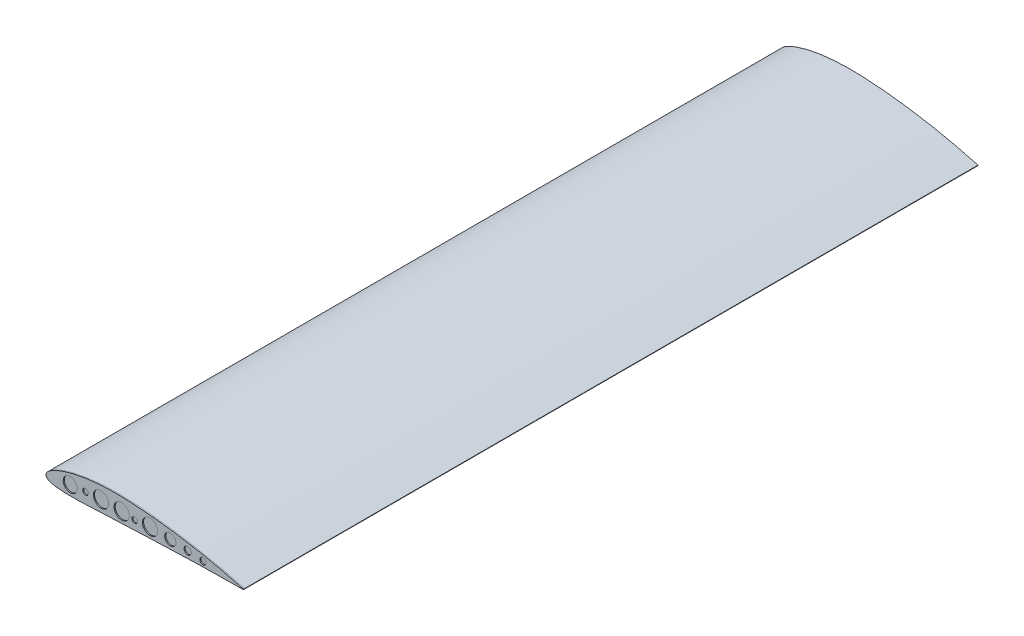
from build123d import *

# Parameters (mm, degrees)
SKETCH_11_7_R   = 5
SKETCH_11_7_R_2 = 13.5
SKETCH_11_7_R_3 = 12.5
SKETCH_11_7_R_4 = 10
SKETCH_11_7_R_5 = 6.5
SKETCH_11_7_R_6 = 5.5
EXTRUDE_1_DEPTH = 2
SKETCH_10_6_R   = 5
SKETCH_10_6_R_2 = 13.5
SKETCH_10_6_R_3 = 12.5
SKETCH_10_6_R_4 = 10
SKETCH_10_6_R_5 = 6.5
SKETCH_10_6_R_6 = 5.5
EXTRUDE_2_DEPTH = 2
SKETCH_9_5_R    = 5
SKETCH_9_5_R_2  = 13.5
SKETCH_9_5_R_3  = 12.5
SKETCH_9_5_R_4  = 10
SKETCH_9_5_R_5  = 6.5
SKETCH_9_5_R_6  = 5.5
EXTRUDE_3_DEPTH = 2
SKETCH_8_5_R    = 5
SKETCH_8_5_R_2  = 13.5
SKETCH_8_5_R_3  = 12.5
SKETCH_8_5_R_4  = 10
SKETCH_8_5_R_5  = 6.5
SKETCH_8_5_R_6  = 5.5
EXTRUDE_4_DEPTH = 2
SKETCH_7_5_R    = 5
SKETCH_7_5_R_2  = 13.5
SKETCH_7_5_R_3  = 12.5
SKETCH_7_5_R_4  = 10
SKETCH_7_5_R_5  = 6.5
SKETCH_7_5_R_6  = 5.5
EXTRUDE_5_DEPTH = 2
SKETCH_6_5_R    = 5
SKETCH_6_5_R_2  = 13.5
SKETCH_6_5_R_3  = 12.5
SKETCH_6_5_R_4  = 10
SKETCH_6_5_R_5  = 6.5
SKETCH_6_5_R_6  = 5.5
EXTRUDE_6_DEPTH = 2
SKETCH_5_5_R    = 5
SKETCH_5_5_R_2  = 13.5
SKETCH_5_5_R_3  = 12.5
SKETCH_5_5_R_4  = 10
SKETCH_5_5_R_5  = 6.5
SKETCH_5_5_R_6  = 5.5
EXTRUDE_7_DEPTH = 2
SKETCH_4_5_R    = 5
SKETCH_4_5_R_2  = 13.5
SKETCH_4_5_R_3  = 12.5
SKETCH_4_5_R_4  = 10
SKETCH_4_5_R_5  = 6.5
SKETCH_4_5_R_6  = 5.5
EXTRUDE_8_DEPTH = 2
SKETCH_1_7_R    = 5
SKETCH_1_7_R_2  = 13.5
SKETCH_1_7_R_3  = 12.5
SKETCH_1_7_R_4  = 10
SKETCH_1_7_R_5  = 6.5
SKETCH_1_7_R_6  = 5.5
EXTRUDE_9_DEPTH = 2


with BuildPart() as part:
    # Эскиз11 → По сечениям1 section 0
    with BuildSketch(Plane.XY.offset(1300)):
        with BuildLine():
            Line((350.05845, 0.43715), (349.94155, -0.43715))
            add(Edge.make_bspline(
                [(0, 0), (0.155408818, -0.525722814), (0.476227533, -1.611000465), (1.586769823, -3.040803494), (3.112765198, -4.317437914), (5.093243969, -5.447722375), (7.505717287, -6.445879575), (10.351051726, -7.31627267), (13.620240451, -8.062922714), (17.304665785, -8.689909789), (21.393686603, -9.199252346), (25.875377618, -9.595057971), (30.736698807, -9.883250182), (35.964057985, -10.067767612), (41.543012018, -10.155164492), (47.458655192, -10.152178279), (53.695557513, -10.066352603), (60.237821241, -9.906316155), (67.069008667, -9.679704982), (74.172751269, -9.397340001), (81.531803931, -9.068684171), (89.129023226, -8.703612989), (96.946507158, -8.313449466), (104.966378707, -7.90806886), (113.169923484, -7.499211113), (121.53811338, -7.097117791), (130.051341237, -6.711627842), (138.730507573, -6.35441019), (147.561269223, -6.022976921), (156.518652884, -5.660837494), (165.539001622, -5.289862207), (174.591068127, -4.913048483), (183.650962929, -4.53675194), (192.694676845, -4.166388976), (201.697896598, -3.805227729), (210.636626372, -3.457901715), (219.486483177, -3.12764146), (228.223392336, -2.81587816), (236.823261216, -2.526039513), (245.262463209, -2.257804891), (253.51747776, -2.013136556), (261.565394879, -1.790883859), (269.38360533, -1.591539315), (276.950054357, -1.414351913), (284.243144566, -1.257682185), (291.2419969, -1.120457368), (297.926679662, -1.002271695), (304.277792253, -0.899676861), (310.276923888, -0.812247825), (315.906574984, -0.738654542), (321.150168566, -0.676460713), (325.992191253, -0.624244106), (330.41830186, -0.581511822), (334.415185646, -0.545598108), (337.970958502, -0.51705341), (341.074762753, -0.494129786), (343.717378193, -0.475352957), (345.890648506, -0.461525991), (347.587916237, -0.451081711), (348.803932284, -0.443621511), (349.534966685, -0.439486376), (349.860233337, -0.437617275), (349.94155, -0.43715)],
                knots=[0, 0, 0, 0, 0.004620946, 0.009539266, 0.015079197, 0.021460248, 0.028815323, 0.037216622, 0.046699695, 0.05727715, 0.068944613, 0.081686465, 0.095481238, 0.110299011, 0.126105961, 0.142865946, 0.160538055, 0.179078978, 0.198444346, 0.218585841, 0.239457512, 0.261005992, 0.283182469, 0.305933063, 0.32920473, 0.35294062, 0.37708501, 0.401580457, 0.426713893, 0.452136318, 0.477716493, 0.503387371, 0.529080977, 0.5547274, 0.580258889, 0.605605694, 0.630700189, 0.655471918, 0.679854368, 0.703779236, 0.727181163, 0.749993922, 0.772155213, 0.793601789, 0.814272413, 0.834108781, 0.853053563, 0.871053442, 0.888055013, 0.904008836, 0.918869444, 0.932591329, 0.945133918, 0.956461602, 0.966537736, 0.975333627, 0.982822547, 0.988981708, 0.993791316, 0.997237505, 0.999309376, 1, 1, 1, 1], degree=3))
            add(Edge.make_bspline(
                [(350.05845, 0.43715), (349.9799363, 0.458977364), (349.66618823, 0.546201545), (348.960935498, 0.741026631), (347.787642122, 1.06477769), (346.14888143, 1.513537022), (344.048641496, 2.084391581), (341.491869436, 2.77156767), (338.485180857, 3.5708591), (335.035383832, 4.473825975), (331.151427854, 5.474651074), (326.842561082, 6.564662608), (322.119524995, 7.73478211), (316.994295041, 8.977071941), (311.479528664, 10.280405999), (305.589526082, 11.636117877), (299.339258496, 13.03388727), (292.744646799, 14.462728183), (285.823083247, 15.913831166), (278.592276396, 17.375065599), (271.071360211, 18.836540928), (263.280379398, 20.289171329), (255.2396853, 21.720769393), (246.971132349, 23.123944085), (238.496593165, 24.486034265), (229.839384242, 25.800007282), (221.02284135, 27.05464532), (212.071270387, 28.242752893), (203.009196182, 29.354326972), (193.861826507, 30.381966574), (184.654614057, 31.317146677), (175.413401959, 32.153212465), (166.164322723, 32.883451569), (156.933440075, 33.501480394), (147.739808901, 34.000378509), (138.569107017, 34.389695986), (129.445182431, 34.599821034), (120.403453675, 34.616076111), (111.512634674, 34.441071185), (102.800581937, 34.078308245), (94.29465474, 33.531448412), (86.021563048, 32.807453349), (78.0073005, 31.914509023), (70.276905188, 30.861686404), (62.854295241, 29.660632232), (55.76231382, 28.322939695), (49.022319241, 26.862441348), (42.654463161, 25.293439478), (36.676999584, 23.631177906), (31.107085942, 21.89066593), (25.960019435, 20.087722255), (21.248941586, 18.239321896), (16.986315357, 16.359342059), (13.181653867, 14.464103886), (9.843190221, 12.567222139), (6.9773895, 10.681698857), (4.587466349, 8.818401958), (2.677819187, 6.9857108), (1.242732868, 5.186242471), (0.303080712, 3.420635192), (-0.180166874, 1.671208406), (-0.058773334, 0.545175075), (0, 0)],
                knots=[0, 0, 0, 0, 0.000672677, 0.002688082, 0.006039619, 0.010719677, 0.016713401, 0.024005208, 0.032573738, 0.042394345, 0.053441111, 0.065681418, 0.079082551, 0.09360634, 0.109212938, 0.125858458, 0.143496893, 0.162080373, 0.181556959, 0.201873216, 0.222973729, 0.244799733, 0.267292193, 0.290389422, 0.31402825, 0.338142949, 0.362668597, 0.387537332, 0.412681358, 0.438031691, 0.463518748, 0.48907267, 0.514624056, 0.540102005, 0.565438353, 0.590623799, 0.615867615, 0.640766936, 0.665254038, 0.689266159, 0.712737735, 0.73560582, 0.757811916, 0.779295142, 0.799999596, 0.819872716, 0.838861869, 0.856919509, 0.874001317, 0.890067757, 0.905080712, 0.919010075, 0.931831287, 0.943524753, 0.954082211, 0.963507854, 0.971818447, 0.979061136, 0.985315259, 0.990722623, 0.995508308, 1, 1, 1, 1], degree=3))
        make_face()
    # Эскиз10 → По сечениям1 section 1
    with BuildSketch(Plane.XY.offset(1137.5)):
        with BuildLine():
            Line((350.05845, 0.43715), (349.94155, -0.43715))
            add(Edge.make_bspline(
                [(0, 0), (0.155408818, -0.525722814), (0.476227533, -1.611000465), (1.586769823, -3.040803494), (3.112765198, -4.317437914), (5.093243969, -5.447722375), (7.505717287, -6.445879575), (10.351051726, -7.31627267), (13.620240451, -8.062922714), (17.304665785, -8.689909789), (21.393686603, -9.199252346), (25.875377618, -9.595057971), (30.736698807, -9.883250182), (35.964057985, -10.067767612), (41.543012018, -10.155164492), (47.458655192, -10.152178279), (53.695557513, -10.066352603), (60.237821241, -9.906316155), (67.069008667, -9.679704982), (74.172751269, -9.397340001), (81.531803931, -9.068684171), (89.129023226, -8.703612989), (96.946507158, -8.313449466), (104.966378707, -7.90806886), (113.169923484, -7.499211113), (121.53811338, -7.097117791), (130.051341237, -6.711627842), (138.730507573, -6.35441019), (147.561269223, -6.022976921), (156.518652884, -5.660837494), (165.539001622, -5.289862207), (174.591068127, -4.913048483), (183.650962929, -4.53675194), (192.694676845, -4.166388976), (201.697896598, -3.805227729), (210.636626372, -3.457901715), (219.486483177, -3.12764146), (228.223392336, -2.81587816), (236.823261216, -2.526039513), (245.262463209, -2.257804891), (253.51747776, -2.013136556), (261.565394879, -1.790883859), (269.38360533, -1.591539315), (276.950054357, -1.414351913), (284.243144566, -1.257682185), (291.2419969, -1.120457368), (297.926679662, -1.002271695), (304.277792253, -0.899676861), (310.276923888, -0.812247825), (315.906574984, -0.738654542), (321.150168566, -0.676460713), (325.992191253, -0.624244106), (330.41830186, -0.581511822), (334.415185646, -0.545598108), (337.970958502, -0.51705341), (341.074762753, -0.494129786), (343.717378193, -0.475352957), (345.890648506, -0.461525991), (347.587916237, -0.451081711), (348.803932284, -0.443621511), (349.534966685, -0.439486376), (349.860233337, -0.437617275), (349.94155, -0.43715)],
                knots=[0, 0, 0, 0, 0.004620946, 0.009539266, 0.015079197, 0.021460248, 0.028815323, 0.037216622, 0.046699695, 0.05727715, 0.068944613, 0.081686465, 0.095481238, 0.110299011, 0.126105961, 0.142865946, 0.160538055, 0.179078978, 0.198444346, 0.218585841, 0.239457512, 0.261005992, 0.283182469, 0.305933063, 0.32920473, 0.35294062, 0.37708501, 0.401580457, 0.426713893, 0.452136318, 0.477716493, 0.503387371, 0.529080977, 0.5547274, 0.580258889, 0.605605694, 0.630700189, 0.655471918, 0.679854368, 0.703779236, 0.727181163, 0.749993922, 0.772155213, 0.793601789, 0.814272413, 0.834108781, 0.853053563, 0.871053442, 0.888055013, 0.904008836, 0.918869444, 0.932591329, 0.945133918, 0.956461602, 0.966537736, 0.975333627, 0.982822547, 0.988981708, 0.993791316, 0.997237505, 0.999309376, 1, 1, 1, 1], degree=3))
            add(Edge.make_bspline(
                [(350.05845, 0.43715), (349.9799363, 0.458977364), (349.66618823, 0.546201545), (348.960935498, 0.741026631), (347.787642122, 1.06477769), (346.14888143, 1.513537022), (344.048641496, 2.084391581), (341.491869436, 2.77156767), (338.485180857, 3.5708591), (335.035383832, 4.473825975), (331.151427854, 5.474651074), (326.842561082, 6.564662608), (322.119524995, 7.73478211), (316.994295041, 8.977071941), (311.479528664, 10.280406), (305.589526082, 11.636117877), (299.339258496, 13.03388727), (292.744646799, 14.462728183), (285.823083247, 15.913831166), (278.592276396, 17.375065599), (271.071360211, 18.836540928), (263.280379398, 20.28917133), (255.2396853, 21.720769393), (246.971132349, 23.123944085), (238.496593165, 24.486034265), (229.839384242, 25.800007282), (221.02284135, 27.05464532), (212.071270387, 28.242752893), (203.009196182, 29.354326972), (193.861826507, 30.381966574), (184.654614057, 31.317146677), (175.413401959, 32.153212465), (166.164322723, 32.883451569), (156.933440075, 33.501480394), (147.739808901, 34.000378509), (138.569107017, 34.389695986), (129.445182431, 34.599821034), (120.403453675, 34.616076111), (111.512634674, 34.441071185), (102.800581937, 34.078308245), (94.29465474, 33.531448412), (86.021563048, 32.807453349), (78.0073005, 31.914509023), (70.276905188, 30.861686404), (62.854295241, 29.660632232), (55.76231382, 28.322939695), (49.022319241, 26.862441348), (42.654463161, 25.293439478), (36.676999584, 23.631177906), (31.107085942, 21.89066593), (25.960019435, 20.087722255), (21.248941586, 18.239321896), (16.986315357, 16.359342059), (13.181653867, 14.464103886), (9.843190221, 12.567222139), (6.9773895, 10.681698857), (4.587466349, 8.818401958), (2.677819187, 6.9857108), (1.242732868, 5.186242471), (0.303080712, 3.420635192), (-0.180166874, 1.671208406), (-0.058773334, 0.545175075), (0, 0)],
                knots=[0, 0, 0, 0, 0.000672677, 0.002688082, 0.006039619, 0.010719677, 0.016713401, 0.024005208, 0.032573738, 0.042394345, 0.053441111, 0.065681418, 0.079082551, 0.09360634, 0.109212938, 0.125858458, 0.143496893, 0.162080373, 0.181556959, 0.201873216, 0.222973729, 0.244799733, 0.267292193, 0.290389422, 0.31402825, 0.338142949, 0.362668597, 0.387537332, 0.412681358, 0.438031691, 0.463518748, 0.48907267, 0.514624056, 0.540102005, 0.565438353, 0.590623799, 0.615867615, 0.640766936, 0.665254038, 0.689266159, 0.712737735, 0.73560582, 0.757811916, 0.779295142, 0.799999596, 0.819872716, 0.838861869, 0.856919509, 0.874001317, 0.890067757, 0.905080712, 0.919010075, 0.931831287, 0.943524753, 0.954082211, 0.963507854, 0.971818447, 0.979061136, 0.985315259, 0.990722623, 0.995508308, 1, 1, 1, 1], degree=3))
        make_face()
    # Эскиз9 → По сечениям1 section 2
    with BuildSketch(Plane.XY.offset(975)):
        with BuildLine():
            Line((350.05845, 0.43715), (349.94155, -0.43715))
            add(Edge.make_bspline(
                [(0, 0), (0.155408818, -0.525722814), (0.476227533, -1.611000465), (1.586769823, -3.040803494), (3.112765198, -4.317437914), (5.093243969, -5.447722375), (7.505717287, -6.445879575), (10.351051726, -7.31627267), (13.620240451, -8.062922714), (17.304665785, -8.689909789), (21.393686603, -9.199252346), (25.875377618, -9.595057971), (30.736698807, -9.883250182), (35.964057985, -10.067767612), (41.543012018, -10.155164492), (47.458655192, -10.152178279), (53.695557513, -10.066352603), (60.237821241, -9.906316155), (67.069008667, -9.679704982), (74.172751269, -9.397340001), (81.531803931, -9.068684171), (89.129023226, -8.703612989), (96.946507158, -8.313449466), (104.966378707, -7.90806886), (113.169923484, -7.499211113), (121.53811338, -7.097117791), (130.051341237, -6.711627842), (138.730507573, -6.35441019), (147.561269223, -6.022976921), (156.518652884, -5.660837494), (165.539001622, -5.289862207), (174.591068127, -4.913048483), (183.650962929, -4.53675194), (192.694676845, -4.166388976), (201.697896598, -3.805227729), (210.636626372, -3.457901715), (219.486483177, -3.12764146), (228.223392336, -2.81587816), (236.823261216, -2.526039513), (245.262463209, -2.257804891), (253.51747776, -2.013136556), (261.565394879, -1.790883859), (269.38360533, -1.591539315), (276.950054357, -1.414351913), (284.243144566, -1.257682185), (291.2419969, -1.120457368), (297.926679662, -1.002271695), (304.277792253, -0.899676861), (310.276923888, -0.812247825), (315.906574984, -0.738654542), (321.150168566, -0.676460713), (325.992191253, -0.624244106), (330.41830186, -0.581511822), (334.415185646, -0.545598108), (337.970958502, -0.51705341), (341.074762753, -0.494129786), (343.717378193, -0.475352957), (345.890648506, -0.461525991), (347.587916237, -0.451081711), (348.803932284, -0.443621511), (349.534966685, -0.439486376), (349.860233337, -0.437617275), (349.94155, -0.43715)],
                knots=[0, 0, 0, 0, 0.004620946, 0.009539266, 0.015079197, 0.021460248, 0.028815323, 0.037216622, 0.046699695, 0.05727715, 0.068944613, 0.081686465, 0.095481238, 0.110299011, 0.126105961, 0.142865946, 0.160538055, 0.179078978, 0.198444346, 0.218585841, 0.239457512, 0.261005992, 0.283182469, 0.305933063, 0.32920473, 0.35294062, 0.37708501, 0.401580457, 0.426713893, 0.452136318, 0.477716493, 0.503387371, 0.529080977, 0.5547274, 0.580258889, 0.605605694, 0.630700189, 0.655471918, 0.679854368, 0.703779236, 0.727181163, 0.749993922, 0.772155213, 0.793601789, 0.814272413, 0.834108781, 0.853053563, 0.871053442, 0.888055013, 0.904008836, 0.918869444, 0.932591329, 0.945133918, 0.956461602, 0.966537736, 0.975333627, 0.982822547, 0.988981708, 0.993791316, 0.997237505, 0.999309376, 1, 1, 1, 1], degree=3))
            add(Edge.make_bspline(
                [(350.05845, 0.43715), (349.9799363, 0.458977364), (349.66618823, 0.546201545), (348.960935498, 0.741026631), (347.787642122, 1.06477769), (346.14888143, 1.513537022), (344.048641496, 2.084391581), (341.491869436, 2.77156767), (338.485180857, 3.5708591), (335.035383832, 4.473825975), (331.151427854, 5.474651074), (326.842561082, 6.564662608), (322.119524995, 7.73478211), (316.994295041, 8.977071941), (311.479528664, 10.280405999), (305.589526082, 11.636117877), (299.339258496, 13.03388727), (292.744646799, 14.462728183), (285.823083247, 15.913831166), (278.592276396, 17.375065599), (271.071360211, 18.836540928), (263.280379398, 20.28917133), (255.2396853, 21.720769393), (246.971132349, 23.123944085), (238.496593165, 24.486034265), (229.839384242, 25.800007282), (221.02284135, 27.05464532), (212.071270387, 28.242752893), (203.009196182, 29.354326972), (193.861826507, 30.381966574), (184.654614057, 31.317146677), (175.413401959, 32.153212465), (166.164322723, 32.883451569), (156.933440075, 33.501480394), (147.739808901, 34.000378509), (138.569107017, 34.389695986), (129.445182431, 34.599821034), (120.403453675, 34.616076111), (111.512634674, 34.441071185), (102.800581937, 34.078308245), (94.29465474, 33.531448412), (86.021563048, 32.807453349), (78.0073005, 31.914509023), (70.276905188, 30.861686404), (62.854295241, 29.660632232), (55.76231382, 28.322939695), (49.022319241, 26.862441348), (42.654463161, 25.293439478), (36.676999584, 23.631177906), (31.107085942, 21.89066593), (25.960019435, 20.087722255), (21.248941586, 18.239321896), (16.986315357, 16.359342059), (13.181653867, 14.464103886), (9.843190221, 12.567222139), (6.9773895, 10.681698857), (4.587466349, 8.818401958), (2.677819187, 6.9857108), (1.242732868, 5.186242471), (0.303080712, 3.420635192), (-0.180166874, 1.671208406), (-0.058773334, 0.545175075), (0, 0)],
                knots=[0, 0, 0, 0, 0.000672677, 0.002688082, 0.006039619, 0.010719677, 0.016713401, 0.024005208, 0.032573738, 0.042394345, 0.053441111, 0.065681418, 0.079082551, 0.09360634, 0.109212938, 0.125858458, 0.143496893, 0.162080373, 0.181556959, 0.201873216, 0.222973729, 0.244799733, 0.267292193, 0.290389422, 0.31402825, 0.338142949, 0.362668597, 0.387537332, 0.412681358, 0.438031691, 0.463518748, 0.48907267, 0.514624056, 0.540102005, 0.565438353, 0.590623799, 0.615867615, 0.640766936, 0.665254038, 0.689266159, 0.712737735, 0.73560582, 0.757811916, 0.779295142, 0.799999596, 0.819872716, 0.838861869, 0.856919509, 0.874001317, 0.890067757, 0.905080712, 0.919010075, 0.931831287, 0.943524753, 0.954082211, 0.963507854, 0.971818447, 0.979061136, 0.985315259, 0.990722623, 0.995508308, 1, 1, 1, 1], degree=3))
        make_face()
    # Эскиз8 → По сечениям1 section 3
    with BuildSketch(Plane.XY.offset(812.5)):
        with BuildLine():
            Line((350.05845, 0.43715), (349.94155, -0.43715))
            add(Edge.make_bspline(
                [(0, 0), (0.155408818, -0.525722814), (0.476227533, -1.611000465), (1.586769823, -3.040803494), (3.112765198, -4.317437914), (5.093243969, -5.447722375), (7.505717287, -6.445879575), (10.351051726, -7.31627267), (13.620240451, -8.062922714), (17.304665785, -8.689909789), (21.393686603, -9.199252346), (25.875377618, -9.595057971), (30.736698807, -9.883250182), (35.964057985, -10.067767612), (41.543012018, -10.155164492), (47.458655192, -10.152178279), (53.695557513, -10.066352603), (60.237821241, -9.906316155), (67.069008667, -9.679704982), (74.172751269, -9.397340001), (81.531803931, -9.068684171), (89.129023226, -8.703612989), (96.946507158, -8.313449466), (104.966378707, -7.90806886), (113.169923484, -7.499211113), (121.53811338, -7.097117791), (130.051341237, -6.711627842), (138.730507573, -6.35441019), (147.561269223, -6.022976921), (156.518652884, -5.660837494), (165.539001622, -5.289862207), (174.591068127, -4.913048483), (183.650962929, -4.53675194), (192.694676845, -4.166388976), (201.697896598, -3.805227729), (210.636626372, -3.457901715), (219.486483177, -3.12764146), (228.223392336, -2.81587816), (236.823261216, -2.526039513), (245.262463209, -2.257804891), (253.51747776, -2.013136556), (261.565394879, -1.790883859), (269.38360533, -1.591539315), (276.950054357, -1.414351913), (284.243144566, -1.257682185), (291.2419969, -1.120457368), (297.926679662, -1.002271695), (304.277792253, -0.899676861), (310.276923888, -0.812247825), (315.906574984, -0.738654542), (321.150168566, -0.676460713), (325.992191253, -0.624244106), (330.41830186, -0.581511822), (334.415185646, -0.545598108), (337.970958502, -0.51705341), (341.074762753, -0.494129786), (343.717378193, -0.475352957), (345.890648506, -0.461525991), (347.587916237, -0.451081711), (348.803932284, -0.443621511), (349.534966685, -0.439486376), (349.860233337, -0.437617275), (349.94155, -0.43715)],
                knots=[0, 0, 0, 0, 0.004620946, 0.009539266, 0.015079197, 0.021460248, 0.028815323, 0.037216622, 0.046699695, 0.05727715, 0.068944613, 0.081686465, 0.095481238, 0.110299011, 0.126105961, 0.142865946, 0.160538055, 0.179078978, 0.198444346, 0.218585841, 0.239457512, 0.261005992, 0.283182469, 0.305933063, 0.32920473, 0.35294062, 0.37708501, 0.401580457, 0.426713893, 0.452136318, 0.477716493, 0.503387371, 0.529080977, 0.5547274, 0.580258889, 0.605605694, 0.630700189, 0.655471918, 0.679854368, 0.703779236, 0.727181163, 0.749993922, 0.772155213, 0.793601789, 0.814272413, 0.834108781, 0.853053563, 0.871053442, 0.888055013, 0.904008836, 0.918869444, 0.932591329, 0.945133918, 0.956461602, 0.966537736, 0.975333627, 0.982822547, 0.988981708, 0.993791316, 0.997237505, 0.999309376, 1, 1, 1, 1], degree=3))
            add(Edge.make_bspline(
                [(350.05845, 0.43715), (349.9799363, 0.458977364), (349.66618823, 0.546201545), (348.960935498, 0.741026631), (347.787642122, 1.06477769), (346.14888143, 1.513537022), (344.048641496, 2.084391581), (341.491869436, 2.77156767), (338.485180857, 3.5708591), (335.035383832, 4.473825975), (331.151427854, 5.474651074), (326.842561082, 6.564662608), (322.119524995, 7.73478211), (316.994295041, 8.977071941), (311.479528664, 10.280405999), (305.589526082, 11.636117877), (299.339258496, 13.03388727), (292.744646799, 14.462728183), (285.823083247, 15.913831166), (278.592276396, 17.375065599), (271.071360211, 18.836540928), (263.280379398, 20.28917133), (255.2396853, 21.720769393), (246.971132349, 23.123944085), (238.496593165, 24.486034265), (229.839384242, 25.800007282), (221.02284135, 27.05464532), (212.071270387, 28.242752893), (203.009196182, 29.354326972), (193.861826507, 30.381966574), (184.654614057, 31.317146677), (175.413401959, 32.153212465), (166.164322723, 32.883451569), (156.933440075, 33.501480394), (147.739808901, 34.000378509), (138.569107017, 34.389695986), (129.445182431, 34.599821034), (120.403453675, 34.616076111), (111.512634674, 34.441071185), (102.800581937, 34.078308245), (94.29465474, 33.531448412), (86.021563048, 32.807453349), (78.0073005, 31.914509023), (70.276905188, 30.861686404), (62.854295241, 29.660632232), (55.76231382, 28.322939695), (49.022319241, 26.862441348), (42.654463161, 25.293439478), (36.676999584, 23.631177906), (31.107085942, 21.89066593), (25.960019435, 20.087722255), (21.248941586, 18.239321896), (16.986315357, 16.359342059), (13.181653867, 14.464103886), (9.843190221, 12.567222139), (6.9773895, 10.681698857), (4.587466349, 8.818401958), (2.677819187, 6.9857108), (1.242732868, 5.186242471), (0.303080712, 3.420635192), (-0.180166874, 1.671208406), (-0.058773334, 0.545175075), (0, 0)],
                knots=[0, 0, 0, 0, 0.000672677, 0.002688082, 0.006039619, 0.010719677, 0.016713401, 0.024005208, 0.032573738, 0.042394345, 0.053441111, 0.065681418, 0.079082551, 0.09360634, 0.109212938, 0.125858458, 0.143496893, 0.162080373, 0.181556959, 0.201873216, 0.222973729, 0.244799733, 0.267292193, 0.290389422, 0.31402825, 0.338142949, 0.362668597, 0.387537332, 0.412681358, 0.438031691, 0.463518748, 0.48907267, 0.514624056, 0.540102005, 0.565438353, 0.590623799, 0.615867615, 0.640766936, 0.665254038, 0.689266159, 0.712737735, 0.73560582, 0.757811916, 0.779295142, 0.799999596, 0.819872716, 0.838861869, 0.856919509, 0.874001317, 0.890067757, 0.905080712, 0.919010075, 0.931831287, 0.943524753, 0.954082211, 0.963507854, 0.971818447, 0.979061136, 0.985315259, 0.990722623, 0.995508308, 1, 1, 1, 1], degree=3))
        make_face()
    # Эскиз7 → По сечениям1 section 4
    with BuildSketch(Plane.XY.offset(650)):
        with BuildLine():
            Line((350.05845, 0.43715), (349.94155, -0.43715))
            add(Edge.make_bspline(
                [(0, 0), (0.155408818, -0.525722814), (0.476227533, -1.611000465), (1.586769823, -3.040803494), (3.112765198, -4.317437914), (5.093243969, -5.447722375), (7.505717287, -6.445879575), (10.351051726, -7.31627267), (13.620240451, -8.062922714), (17.304665785, -8.689909789), (21.393686603, -9.199252346), (25.875377618, -9.595057971), (30.736698807, -9.883250182), (35.964057985, -10.067767612), (41.543012018, -10.155164492), (47.458655192, -10.152178279), (53.695557513, -10.066352603), (60.237821241, -9.906316155), (67.069008667, -9.679704982), (74.172751269, -9.397340001), (81.531803931, -9.068684171), (89.129023226, -8.703612989), (96.946507158, -8.313449466), (104.966378707, -7.90806886), (113.169923484, -7.499211113), (121.53811338, -7.097117791), (130.051341237, -6.711627842), (138.730507573, -6.35441019), (147.561269223, -6.022976921), (156.518652884, -5.660837494), (165.539001622, -5.289862207), (174.591068127, -4.913048483), (183.650962929, -4.53675194), (192.694676845, -4.166388976), (201.697896598, -3.805227729), (210.636626372, -3.457901715), (219.486483177, -3.12764146), (228.223392336, -2.81587816), (236.823261216, -2.526039513), (245.262463209, -2.257804891), (253.51747776, -2.013136556), (261.565394879, -1.790883859), (269.38360533, -1.591539315), (276.950054357, -1.414351913), (284.243144566, -1.257682185), (291.2419969, -1.120457368), (297.926679662, -1.002271695), (304.277792253, -0.899676861), (310.276923888, -0.812247825), (315.906574984, -0.738654542), (321.150168566, -0.676460713), (325.992191253, -0.624244106), (330.41830186, -0.581511822), (334.415185646, -0.545598108), (337.970958502, -0.51705341), (341.074762753, -0.494129786), (343.717378193, -0.475352957), (345.890648506, -0.461525991), (347.587916237, -0.451081711), (348.803932284, -0.443621511), (349.534966685, -0.439486376), (349.860233337, -0.437617275), (349.94155, -0.43715)],
                knots=[0, 0, 0, 0, 0.004620946, 0.009539266, 0.015079197, 0.021460248, 0.028815323, 0.037216622, 0.046699695, 0.05727715, 0.068944613, 0.081686465, 0.095481238, 0.110299011, 0.126105961, 0.142865946, 0.160538055, 0.179078978, 0.198444346, 0.218585841, 0.239457512, 0.261005992, 0.283182469, 0.305933063, 0.32920473, 0.35294062, 0.37708501, 0.401580457, 0.426713893, 0.452136318, 0.477716493, 0.503387371, 0.529080977, 0.5547274, 0.580258889, 0.605605694, 0.630700189, 0.655471918, 0.679854368, 0.703779236, 0.727181163, 0.749993922, 0.772155213, 0.793601789, 0.814272413, 0.834108781, 0.853053563, 0.871053442, 0.888055013, 0.904008836, 0.918869444, 0.932591329, 0.945133918, 0.956461602, 0.966537736, 0.975333627, 0.982822547, 0.988981708, 0.993791316, 0.997237505, 0.999309376, 1, 1, 1, 1], degree=3))
            add(Edge.make_bspline(
                [(350.05845, 0.43715), (349.9799363, 0.458977364), (349.66618823, 0.546201545), (348.960935498, 0.741026631), (347.787642122, 1.06477769), (346.14888143, 1.513537022), (344.048641496, 2.084391581), (341.491869436, 2.77156767), (338.485180857, 3.5708591), (335.035383832, 4.473825975), (331.151427854, 5.474651074), (326.842561082, 6.564662608), (322.119524995, 7.73478211), (316.994295041, 8.977071941), (311.479528664, 10.280405999), (305.589526082, 11.636117877), (299.339258496, 13.03388727), (292.744646799, 14.462728183), (285.823083247, 15.913831166), (278.592276396, 17.375065599), (271.071360211, 18.836540928), (263.280379398, 20.28917133), (255.2396853, 21.720769393), (246.971132349, 23.123944085), (238.496593165, 24.486034265), (229.839384242, 25.800007282), (221.02284135, 27.05464532), (212.071270387, 28.242752893), (203.009196182, 29.354326972), (193.861826507, 30.381966574), (184.654614057, 31.317146677), (175.413401959, 32.153212465), (166.164322723, 32.883451569), (156.933440075, 33.501480394), (147.739808901, 34.000378509), (138.569107017, 34.389695986), (129.445182431, 34.599821034), (120.403453675, 34.616076111), (111.512634674, 34.441071185), (102.800581937, 34.078308245), (94.29465474, 33.531448412), (86.021563048, 32.807453349), (78.0073005, 31.914509023), (70.276905188, 30.861686404), (62.854295241, 29.660632232), (55.76231382, 28.322939695), (49.022319241, 26.862441348), (42.654463161, 25.293439478), (36.676999584, 23.631177906), (31.107085942, 21.89066593), (25.960019435, 20.087722255), (21.248941586, 18.239321896), (16.986315357, 16.359342059), (13.181653867, 14.464103886), (9.843190221, 12.567222139), (6.9773895, 10.681698857), (4.587466349, 8.818401958), (2.677819187, 6.9857108), (1.242732868, 5.186242471), (0.303080712, 3.420635192), (-0.180166874, 1.671208406), (-0.058773334, 0.545175075), (0, 0)],
                knots=[0, 0, 0, 0, 0.000672677, 0.002688082, 0.006039619, 0.010719677, 0.016713401, 0.024005208, 0.032573738, 0.042394345, 0.053441111, 0.065681418, 0.079082551, 0.09360634, 0.109212938, 0.125858458, 0.143496893, 0.162080373, 0.181556959, 0.201873216, 0.222973729, 0.244799733, 0.267292193, 0.290389422, 0.31402825, 0.338142949, 0.362668597, 0.387537332, 0.412681358, 0.438031691, 0.463518748, 0.48907267, 0.514624056, 0.540102005, 0.565438353, 0.590623799, 0.615867615, 0.640766936, 0.665254038, 0.689266159, 0.712737735, 0.73560582, 0.757811916, 0.779295142, 0.799999596, 0.819872716, 0.838861869, 0.856919509, 0.874001317, 0.890067757, 0.905080712, 0.919010075, 0.931831287, 0.943524753, 0.954082211, 0.963507854, 0.971818447, 0.979061136, 0.985315259, 0.990722623, 0.995508308, 1, 1, 1, 1], degree=3))
        make_face()
    # Эскиз6 → По сечениям1 section 5
    with BuildSketch(Plane.XY.offset(487.5)):
        with BuildLine():
            Line((350.05845, 0.43715), (349.94155, -0.43715))
            add(Edge.make_bspline(
                [(0, 0), (0.155408818, -0.525722814), (0.476227533, -1.611000465), (1.586769823, -3.040803494), (3.112765198, -4.317437914), (5.093243969, -5.447722375), (7.505717287, -6.445879575), (10.351051726, -7.31627267), (13.620240451, -8.062922714), (17.304665785, -8.689909789), (21.393686603, -9.199252346), (25.875377618, -9.595057971), (30.736698807, -9.883250182), (35.964057985, -10.067767612), (41.543012018, -10.155164492), (47.458655192, -10.152178279), (53.695557513, -10.066352603), (60.237821241, -9.906316155), (67.069008667, -9.679704982), (74.172751269, -9.397340001), (81.531803931, -9.068684171), (89.129023226, -8.703612989), (96.946507158, -8.313449466), (104.966378707, -7.90806886), (113.169923484, -7.499211113), (121.53811338, -7.097117791), (130.051341237, -6.711627842), (138.730507573, -6.35441019), (147.561269223, -6.022976921), (156.518652884, -5.660837494), (165.539001622, -5.289862207), (174.591068127, -4.913048483), (183.650962929, -4.53675194), (192.694676845, -4.166388976), (201.697896598, -3.805227729), (210.636626372, -3.457901715), (219.486483177, -3.12764146), (228.223392336, -2.81587816), (236.823261216, -2.526039513), (245.262463209, -2.257804891), (253.51747776, -2.013136556), (261.565394879, -1.790883859), (269.38360533, -1.591539315), (276.950054357, -1.414351913), (284.243144566, -1.257682185), (291.2419969, -1.120457368), (297.926679662, -1.002271695), (304.277792253, -0.899676861), (310.276923888, -0.812247825), (315.906574984, -0.738654542), (321.150168566, -0.676460713), (325.992191253, -0.624244106), (330.41830186, -0.581511822), (334.415185646, -0.545598108), (337.970958502, -0.51705341), (341.074762753, -0.494129786), (343.717378193, -0.475352957), (345.890648506, -0.461525991), (347.587916237, -0.451081711), (348.803932284, -0.443621511), (349.534966685, -0.439486376), (349.860233337, -0.437617275), (349.94155, -0.43715)],
                knots=[0, 0, 0, 0, 0.004620946, 0.009539266, 0.015079197, 0.021460248, 0.028815323, 0.037216622, 0.046699695, 0.05727715, 0.068944613, 0.081686465, 0.095481238, 0.110299011, 0.126105961, 0.142865946, 0.160538055, 0.179078978, 0.198444346, 0.218585841, 0.239457512, 0.261005992, 0.283182469, 0.305933063, 0.32920473, 0.35294062, 0.37708501, 0.401580457, 0.426713893, 0.452136318, 0.477716493, 0.503387371, 0.529080977, 0.5547274, 0.580258889, 0.605605694, 0.630700189, 0.655471918, 0.679854368, 0.703779236, 0.727181163, 0.749993922, 0.772155213, 0.793601789, 0.814272413, 0.834108781, 0.853053563, 0.871053442, 0.888055013, 0.904008836, 0.918869444, 0.932591329, 0.945133918, 0.956461602, 0.966537736, 0.975333627, 0.982822547, 0.988981708, 0.993791316, 0.997237505, 0.999309376, 1, 1, 1, 1], degree=3))
            add(Edge.make_bspline(
                [(350.05845, 0.43715), (349.9799363, 0.458977364), (349.66618823, 0.546201545), (348.960935498, 0.741026631), (347.787642122, 1.06477769), (346.14888143, 1.513537022), (344.048641496, 2.084391581), (341.491869436, 2.77156767), (338.485180857, 3.5708591), (335.035383832, 4.473825975), (331.151427854, 5.474651074), (326.842561082, 6.564662608), (322.119524995, 7.73478211), (316.994295041, 8.977071941), (311.479528664, 10.280405999), (305.589526082, 11.636117877), (299.339258496, 13.03388727), (292.744646799, 14.462728183), (285.823083247, 15.913831166), (278.592276396, 17.375065599), (271.071360211, 18.836540928), (263.280379398, 20.28917133), (255.2396853, 21.720769393), (246.971132349, 23.123944085), (238.496593165, 24.486034265), (229.839384242, 25.800007282), (221.02284135, 27.05464532), (212.071270387, 28.242752893), (203.009196182, 29.354326972), (193.861826507, 30.381966574), (184.654614057, 31.317146677), (175.413401959, 32.153212465), (166.164322723, 32.883451569), (156.933440075, 33.501480394), (147.739808901, 34.000378509), (138.569107017, 34.389695986), (129.445182431, 34.599821034), (120.403453675, 34.616076111), (111.512634674, 34.441071185), (102.800581937, 34.078308245), (94.29465474, 33.531448412), (86.021563048, 32.807453349), (78.0073005, 31.914509023), (70.276905188, 30.861686404), (62.854295241, 29.660632232), (55.76231382, 28.322939695), (49.022319241, 26.862441348), (42.654463161, 25.293439478), (36.676999584, 23.631177906), (31.107085942, 21.89066593), (25.960019435, 20.087722255), (21.248941586, 18.239321896), (16.986315357, 16.359342059), (13.181653867, 14.464103886), (9.843190221, 12.567222139), (6.9773895, 10.681698857), (4.587466349, 8.818401958), (2.677819187, 6.9857108), (1.242732868, 5.186242471), (0.303080712, 3.420635192), (-0.180166874, 1.671208406), (-0.058773334, 0.545175075), (0, 0)],
                knots=[0, 0, 0, 0, 0.000672677, 0.002688082, 0.006039619, 0.010719677, 0.016713401, 0.024005208, 0.032573738, 0.042394345, 0.053441111, 0.065681418, 0.079082551, 0.09360634, 0.109212938, 0.125858458, 0.143496893, 0.162080373, 0.181556959, 0.201873216, 0.222973729, 0.244799733, 0.267292193, 0.290389422, 0.31402825, 0.338142949, 0.362668597, 0.387537332, 0.412681358, 0.438031691, 0.463518748, 0.48907267, 0.514624056, 0.540102005, 0.565438353, 0.590623799, 0.615867615, 0.640766936, 0.665254038, 0.689266159, 0.712737735, 0.73560582, 0.757811916, 0.779295142, 0.799999596, 0.819872716, 0.838861869, 0.856919509, 0.874001317, 0.890067757, 0.905080712, 0.919010075, 0.931831287, 0.943524753, 0.954082211, 0.963507854, 0.971818447, 0.979061136, 0.985315259, 0.990722623, 0.995508308, 1, 1, 1, 1], degree=3))
        make_face()
    # Эскиз5 → По сечениям1 section 6
    with BuildSketch(Plane.XY.offset(325)):
        with BuildLine():
            Line((350.05845, 0.43715), (349.94155, -0.43715))
            add(Edge.make_bspline(
                [(0, 0), (0.155408818, -0.525722814), (0.476227533, -1.611000465), (1.586769823, -3.040803494), (3.112765198, -4.317437914), (5.093243969, -5.447722375), (7.505717287, -6.445879575), (10.351051726, -7.31627267), (13.620240451, -8.062922714), (17.304665785, -8.689909789), (21.393686603, -9.199252346), (25.875377618, -9.595057971), (30.736698807, -9.883250182), (35.964057985, -10.067767612), (41.543012018, -10.155164492), (47.458655192, -10.152178279), (53.695557513, -10.066352603), (60.237821241, -9.906316155), (67.069008667, -9.679704982), (74.172751269, -9.397340001), (81.531803931, -9.068684171), (89.129023226, -8.703612989), (96.946507158, -8.313449466), (104.966378707, -7.90806886), (113.169923484, -7.499211113), (121.53811338, -7.097117791), (130.051341237, -6.711627842), (138.730507573, -6.35441019), (147.561269223, -6.022976921), (156.518652884, -5.660837494), (165.539001622, -5.289862207), (174.591068127, -4.913048483), (183.650962929, -4.53675194), (192.694676845, -4.166388976), (201.697896598, -3.805227729), (210.636626372, -3.457901715), (219.486483177, -3.12764146), (228.223392336, -2.81587816), (236.823261216, -2.526039513), (245.262463209, -2.257804891), (253.51747776, -2.013136556), (261.565394879, -1.790883859), (269.38360533, -1.591539315), (276.950054357, -1.414351913), (284.243144566, -1.257682185), (291.2419969, -1.120457368), (297.926679662, -1.002271695), (304.277792253, -0.899676861), (310.276923888, -0.812247825), (315.906574984, -0.738654542), (321.150168566, -0.676460713), (325.992191253, -0.624244106), (330.41830186, -0.581511822), (334.415185646, -0.545598108), (337.970958502, -0.51705341), (341.074762753, -0.494129786), (343.717378193, -0.475352957), (345.890648506, -0.461525991), (347.587916237, -0.451081711), (348.803932284, -0.443621511), (349.534966685, -0.439486376), (349.860233337, -0.437617275), (349.94155, -0.43715)],
                knots=[0, 0, 0, 0, 0.004620946, 0.009539266, 0.015079197, 0.021460248, 0.028815323, 0.037216622, 0.046699695, 0.05727715, 0.068944613, 0.081686465, 0.095481238, 0.110299011, 0.126105961, 0.142865946, 0.160538055, 0.179078978, 0.198444346, 0.218585841, 0.239457512, 0.261005992, 0.283182469, 0.305933063, 0.32920473, 0.35294062, 0.37708501, 0.401580457, 0.426713893, 0.452136318, 0.477716493, 0.503387371, 0.529080977, 0.5547274, 0.580258889, 0.605605694, 0.630700189, 0.655471918, 0.679854368, 0.703779236, 0.727181163, 0.749993922, 0.772155213, 0.793601789, 0.814272413, 0.834108781, 0.853053563, 0.871053442, 0.888055013, 0.904008836, 0.918869444, 0.932591329, 0.945133918, 0.956461602, 0.966537736, 0.975333627, 0.982822547, 0.988981708, 0.993791316, 0.997237505, 0.999309376, 1, 1, 1, 1], degree=3))
            add(Edge.make_bspline(
                [(350.05845, 0.43715), (349.9799363, 0.458977364), (349.66618823, 0.546201545), (348.960935498, 0.741026631), (347.787642122, 1.06477769), (346.14888143, 1.513537022), (344.048641496, 2.084391581), (341.491869436, 2.77156767), (338.485180857, 3.5708591), (335.035383832, 4.473825975), (331.151427854, 5.474651074), (326.842561082, 6.564662608), (322.119524995, 7.73478211), (316.994295041, 8.977071941), (311.479528664, 10.280405999), (305.589526082, 11.636117877), (299.339258496, 13.03388727), (292.744646799, 14.462728183), (285.823083247, 15.913831166), (278.592276396, 17.375065599), (271.071360211, 18.836540928), (263.280379398, 20.289171329), (255.2396853, 21.720769393), (246.971132349, 23.123944085), (238.496593165, 24.486034265), (229.839384242, 25.800007282), (221.02284135, 27.05464532), (212.071270387, 28.242752893), (203.009196182, 29.354326972), (193.861826507, 30.381966574), (184.654614057, 31.317146677), (175.413401959, 32.153212465), (166.164322723, 32.883451569), (156.933440075, 33.501480394), (147.739808901, 34.000378509), (138.569107017, 34.389695986), (129.445182431, 34.599821034), (120.403453675, 34.616076111), (111.512634674, 34.441071185), (102.800581937, 34.078308245), (94.29465474, 33.531448412), (86.021563048, 32.807453349), (78.0073005, 31.914509023), (70.276905188, 30.861686404), (62.854295241, 29.660632232), (55.76231382, 28.322939695), (49.022319241, 26.862441348), (42.654463161, 25.293439478), (36.676999584, 23.631177906), (31.107085942, 21.89066593), (25.960019435, 20.087722255), (21.248941586, 18.239321896), (16.986315357, 16.359342059), (13.181653867, 14.464103886), (9.843190221, 12.567222139), (6.9773895, 10.681698857), (4.587466349, 8.818401958), (2.677819187, 6.9857108), (1.242732868, 5.186242471), (0.303080712, 3.420635192), (-0.180166874, 1.671208406), (-0.058773334, 0.545175075), (0, 0)],
                knots=[0, 0, 0, 0, 0.000672677, 0.002688082, 0.006039619, 0.010719677, 0.016713401, 0.024005208, 0.032573738, 0.042394345, 0.053441111, 0.065681418, 0.079082551, 0.09360634, 0.109212938, 0.125858458, 0.143496893, 0.162080373, 0.181556959, 0.201873216, 0.222973729, 0.244799733, 0.267292193, 0.290389422, 0.31402825, 0.338142949, 0.362668597, 0.387537332, 0.412681358, 0.438031691, 0.463518748, 0.48907267, 0.514624056, 0.540102005, 0.565438353, 0.590623799, 0.615867615, 0.640766936, 0.665254038, 0.689266159, 0.712737735, 0.73560582, 0.757811916, 0.779295142, 0.799999596, 0.819872716, 0.838861869, 0.856919509, 0.874001317, 0.890067757, 0.905080712, 0.919010075, 0.931831287, 0.943524753, 0.954082211, 0.963507854, 0.971818447, 0.979061136, 0.985315259, 0.990722623, 0.995508308, 1, 1, 1, 1], degree=3))
        make_face()
    # Эскиз4 → По сечениям1 section 7
    with BuildSketch(Plane.XY.offset(162.5)):
        with BuildLine():
            Line((350.05845, 0.43715), (349.94155, -0.43715))
            add(Edge.make_bspline(
                [(0, 0), (0.155408818, -0.525722814), (0.476227533, -1.611000465), (1.586769823, -3.040803494), (3.112765198, -4.317437914), (5.093243969, -5.447722375), (7.505717287, -6.445879575), (10.351051726, -7.316272669), (13.620240451, -8.062922714), (17.304665785, -8.689909789), (21.393686603, -9.199252346), (25.875377618, -9.595057971), (30.736698807, -9.883250182), (35.964057985, -10.067767612), (41.543012018, -10.155164492), (47.458655192, -10.152178279), (53.695557513, -10.066352603), (60.237821241, -9.906316155), (67.069008667, -9.679704982), (74.172751269, -9.397340001), (81.531803931, -9.068684171), (89.129023226, -8.703612989), (96.946507158, -8.313449466), (104.966378707, -7.90806886), (113.169923484, -7.499211113), (121.53811338, -7.097117791), (130.051341237, -6.711627842), (138.730507573, -6.35441019), (147.561269223, -6.022976921), (156.518652884, -5.660837494), (165.539001622, -5.289862207), (174.591068127, -4.913048483), (183.650962929, -4.53675194), (192.694676845, -4.166388976), (201.697896598, -3.805227729), (210.636626372, -3.457901715), (219.486483177, -3.12764146), (228.223392336, -2.81587816), (236.823261216, -2.526039513), (245.262463209, -2.257804891), (253.51747776, -2.013136556), (261.565394879, -1.790883859), (269.38360533, -1.591539315), (276.950054357, -1.414351913), (284.243144566, -1.257682185), (291.2419969, -1.120457368), (297.926679662, -1.002271695), (304.277792253, -0.899676861), (310.276923888, -0.812247825), (315.906574984, -0.738654542), (321.150168566, -0.676460713), (325.992191253, -0.624244106), (330.41830186, -0.581511822), (334.415185646, -0.545598108), (337.970958502, -0.51705341), (341.074762753, -0.494129786), (343.717378193, -0.475352957), (345.890648506, -0.461525991), (347.587916237, -0.451081711), (348.803932284, -0.443621511), (349.534966685, -0.439486376), (349.860233337, -0.437617275), (349.94155, -0.43715)],
                knots=[0, 0, 0, 0, 0.004620946, 0.009539266, 0.015079197, 0.021460248, 0.028815323, 0.037216622, 0.046699695, 0.05727715, 0.068944613, 0.081686465, 0.095481238, 0.110299011, 0.126105961, 0.142865946, 0.160538055, 0.179078978, 0.198444346, 0.218585841, 0.239457512, 0.261005992, 0.283182469, 0.305933063, 0.32920473, 0.35294062, 0.37708501, 0.401580457, 0.426713893, 0.452136318, 0.477716493, 0.503387371, 0.529080977, 0.5547274, 0.580258889, 0.605605694, 0.630700189, 0.655471918, 0.679854368, 0.703779236, 0.727181163, 0.749993922, 0.772155213, 0.793601789, 0.814272413, 0.834108781, 0.853053563, 0.871053442, 0.888055013, 0.904008836, 0.918869444, 0.932591329, 0.945133918, 0.956461602, 0.966537736, 0.975333627, 0.982822547, 0.988981708, 0.993791316, 0.997237505, 0.999309376, 1, 1, 1, 1], degree=3))
            add(Edge.make_bspline(
                [(350.05845, 0.43715), (349.9799363, 0.458977364), (349.66618823, 0.546201545), (348.960935498, 0.741026631), (347.787642122, 1.06477769), (346.14888143, 1.513537022), (344.048641496, 2.084391581), (341.491869436, 2.77156767), (338.485180857, 3.5708591), (335.035383832, 4.473825975), (331.151427854, 5.474651074), (326.842561082, 6.564662608), (322.119524995, 7.73478211), (316.994295041, 8.977071941), (311.479528664, 10.280406), (305.589526082, 11.636117877), (299.339258496, 13.03388727), (292.744646799, 14.462728183), (285.823083247, 15.913831166), (278.592276396, 17.375065599), (271.071360211, 18.836540928), (263.280379398, 20.28917133), (255.2396853, 21.720769393), (246.971132349, 23.123944085), (238.496593165, 24.486034265), (229.839384242, 25.800007282), (221.02284135, 27.05464532), (212.071270387, 28.242752893), (203.009196182, 29.354326972), (193.861826507, 30.381966574), (184.654614057, 31.317146677), (175.413401959, 32.153212465), (166.164322723, 32.883451569), (156.933440075, 33.501480394), (147.739808901, 34.000378509), (138.569107017, 34.389695986), (129.445182431, 34.599821034), (120.403453675, 34.616076111), (111.512634674, 34.441071185), (102.800581937, 34.078308245), (94.29465474, 33.531448412), (86.021563048, 32.807453349), (78.0073005, 31.914509023), (70.276905188, 30.861686404), (62.854295241, 29.660632232), (55.76231382, 28.322939695), (49.022319241, 26.862441348), (42.654463161, 25.293439478), (36.676999584, 23.631177906), (31.107085942, 21.89066593), (25.960019435, 20.087722255), (21.248941586, 18.239321896), (16.986315357, 16.359342059), (13.181653867, 14.464103887), (9.843190221, 12.567222139), (6.9773895, 10.681698857), (4.587466349, 8.818401958), (2.677819187, 6.9857108), (1.242732868, 5.186242471), (0.303080712, 3.420635192), (-0.180166874, 1.671208406), (-0.058773334, 0.545175075), (0, 0)],
                knots=[0, 0, 0, 0, 0.000672677, 0.002688082, 0.006039619, 0.010719677, 0.016713401, 0.024005208, 0.032573738, 0.042394345, 0.053441111, 0.065681418, 0.079082551, 0.09360634, 0.109212938, 0.125858458, 0.143496893, 0.162080373, 0.181556959, 0.201873216, 0.222973729, 0.244799733, 0.267292193, 0.290389422, 0.31402825, 0.338142949, 0.362668597, 0.387537332, 0.412681358, 0.438031691, 0.463518748, 0.48907267, 0.514624056, 0.540102005, 0.565438353, 0.590623799, 0.615867615, 0.640766936, 0.665254038, 0.689266159, 0.712737735, 0.73560582, 0.757811916, 0.779295142, 0.799999596, 0.819872716, 0.838861869, 0.856919509, 0.874001317, 0.890067757, 0.905080712, 0.919010075, 0.931831287, 0.943524753, 0.954082211, 0.963507854, 0.971818447, 0.979061136, 0.985315259, 0.990722623, 0.995508308, 1, 1, 1, 1], degree=3))
        make_face()
    # Эскиз1 → По сечениям1 section 8
    with BuildSketch(Plane.XY):
        with BuildLine():
            Line((350.05845, 0.43715), (349.94155, -0.43715))
            add(Edge.make_bspline(
                [(0, 0), (0.155408818, -0.525722814), (0.476227533, -1.611000465), (1.586769823, -3.040803494), (3.112765198, -4.317437914), (5.093243969, -5.447722375), (7.505717287, -6.445879575), (10.351051726, -7.31627267), (13.620240451, -8.062922714), (17.304665785, -8.689909789), (21.393686603, -9.199252346), (25.875377618, -9.595057971), (30.736698807, -9.883250182), (35.964057985, -10.067767612), (41.543012018, -10.155164492), (47.458655192, -10.152178279), (53.695557513, -10.066352603), (60.237821241, -9.906316155), (67.069008667, -9.679704982), (74.172751269, -9.397340001), (81.531803931, -9.068684171), (89.129023226, -8.703612989), (96.946507158, -8.313449466), (104.966378707, -7.90806886), (113.169923484, -7.499211113), (121.53811338, -7.097117791), (130.051341237, -6.711627842), (138.730507573, -6.35441019), (147.561269223, -6.022976921), (156.518652884, -5.660837494), (165.539001622, -5.289862207), (174.591068127, -4.913048483), (183.650962929, -4.53675194), (192.694676845, -4.166388976), (201.697896598, -3.805227729), (210.636626372, -3.457901715), (219.486483177, -3.12764146), (228.223392336, -2.81587816), (236.823261216, -2.526039513), (245.262463209, -2.257804891), (253.51747776, -2.013136556), (261.565394879, -1.790883859), (269.38360533, -1.591539315), (276.950054357, -1.414351913), (284.243144566, -1.257682185), (291.2419969, -1.120457368), (297.926679662, -1.002271695), (304.277792253, -0.899676861), (310.276923888, -0.812247825), (315.906574984, -0.738654542), (321.150168566, -0.676460713), (325.992191253, -0.624244106), (330.41830186, -0.581511822), (334.415185646, -0.545598108), (337.970958502, -0.51705341), (341.074762753, -0.494129786), (343.717378193, -0.475352957), (345.890648506, -0.461525991), (347.587916237, -0.451081711), (348.803932284, -0.443621511), (349.534966685, -0.439486376), (349.860233337, -0.437617275), (349.94155, -0.43715)],
                knots=[0, 0, 0, 0, 0.004620946, 0.009539266, 0.015079197, 0.021460248, 0.028815323, 0.037216622, 0.046699695, 0.05727715, 0.068944613, 0.081686465, 0.095481238, 0.110299011, 0.126105961, 0.142865946, 0.160538055, 0.179078978, 0.198444346, 0.218585841, 0.239457512, 0.261005992, 0.283182469, 0.305933063, 0.32920473, 0.35294062, 0.37708501, 0.401580457, 0.426713893, 0.452136318, 0.477716493, 0.503387371, 0.529080977, 0.5547274, 0.580258889, 0.605605694, 0.630700189, 0.655471918, 0.679854368, 0.703779236, 0.727181163, 0.749993922, 0.772155213, 0.793601789, 0.814272413, 0.834108781, 0.853053563, 0.871053442, 0.888055013, 0.904008836, 0.918869444, 0.932591329, 0.945133918, 0.956461602, 0.966537736, 0.975333627, 0.982822547, 0.988981708, 0.993791316, 0.997237505, 0.999309376, 1, 1, 1, 1], degree=3))
            add(Edge.make_bspline(
                [(350.05845, 0.43715), (349.9799363, 0.458977364), (349.66618823, 0.546201545), (348.960935498, 0.741026631), (347.787642122, 1.06477769), (346.14888143, 1.513537022), (344.048641496, 2.084391581), (341.491869436, 2.77156767), (338.485180857, 3.5708591), (335.035383832, 4.473825975), (331.151427854, 5.474651074), (326.842561082, 6.564662608), (322.119524995, 7.73478211), (316.994295041, 8.977071941), (311.479528664, 10.280406), (305.589526082, 11.636117877), (299.339258496, 13.03388727), (292.744646799, 14.462728183), (285.823083247, 15.913831166), (278.592276396, 17.375065599), (271.071360211, 18.836540928), (263.280379398, 20.28917133), (255.2396853, 21.720769393), (246.971132349, 23.123944085), (238.496593165, 24.486034265), (229.839384242, 25.800007282), (221.02284135, 27.05464532), (212.071270387, 28.242752893), (203.009196182, 29.354326972), (193.861826507, 30.381966574), (184.654614057, 31.317146677), (175.413401959, 32.153212465), (166.164322723, 32.883451569), (156.933440075, 33.501480394), (147.739808901, 34.000378509), (138.569107017, 34.389695986), (129.445182431, 34.599821034), (120.403453675, 34.616076111), (111.512634674, 34.441071185), (102.800581937, 34.078308245), (94.29465474, 33.531448412), (86.021563048, 32.807453349), (78.0073005, 31.914509023), (70.276905188, 30.861686404), (62.854295241, 29.660632232), (55.76231382, 28.322939695), (49.022319241, 26.862441348), (42.654463161, 25.293439478), (36.676999584, 23.631177906), (31.107085942, 21.89066593), (25.960019435, 20.087722255), (21.248941586, 18.239321896), (16.986315357, 16.359342059), (13.181653867, 14.464103886), (9.843190221, 12.567222139), (6.9773895, 10.681698857), (4.587466349, 8.818401958), (2.677819187, 6.9857108), (1.242732868, 5.186242471), (0.303080712, 3.420635192), (-0.180166874, 1.671208406), (-0.058773334, 0.545175075), (0, 0)],
                knots=[0, 0, 0, 0, 0.000672677, 0.002688082, 0.006039619, 0.010719677, 0.016713401, 0.024005208, 0.032573738, 0.042394345, 0.053441111, 0.065681418, 0.079082551, 0.09360634, 0.109212938, 0.125858458, 0.143496893, 0.162080373, 0.181556959, 0.201873216, 0.222973729, 0.244799733, 0.267292193, 0.290389422, 0.31402825, 0.338142949, 0.362668597, 0.387537332, 0.412681358, 0.438031691, 0.463518748, 0.48907267, 0.514624056, 0.540102005, 0.565438353, 0.590623799, 0.615867615, 0.640766936, 0.665254038, 0.689266159, 0.712737735, 0.73560582, 0.757811916, 0.779295142, 0.799999596, 0.819872716, 0.838861869, 0.856919509, 0.874001317, 0.890067757, 0.905080712, 0.919010075, 0.931831287, 0.943524753, 0.954082211, 0.963507854, 0.971818447, 0.979061136, 0.985315259, 0.990722623, 0.995508308, 1, 1, 1, 1], degree=3))
        make_face()
    loft()

    # Эскиз11<7> → Бобышка-Вытянуть1 (add)
    with BuildSketch(Plane.XY.offset(1300)):
        with BuildLine():
            Line((350.05845, 0.43715), (349.94155, -0.43715))
            add(Edge.make_bspline(
                [(0, 0), (0.155408818, -0.525722814), (0.476227533, -1.611000465), (1.586769823, -3.040803494), (3.112765198, -4.317437914), (5.093243969, -5.447722375), (7.505717287, -6.445879575), (10.351051726, -7.31627267), (13.620240451, -8.062922714), (17.304665785, -8.689909789), (21.393686603, -9.199252346), (25.875377618, -9.595057971), (30.736698807, -9.883250182), (35.964057985, -10.067767612), (41.543012018, -10.155164492), (47.458655192, -10.152178279), (53.695557513, -10.066352603), (60.237821241, -9.906316155), (67.069008667, -9.679704982), (74.172751269, -9.397340001), (81.531803931, -9.068684171), (89.129023226, -8.703612989), (96.946507158, -8.313449466), (104.966378707, -7.90806886), (113.169923484, -7.499211113), (121.53811338, -7.097117791), (130.051341237, -6.711627842), (138.730507573, -6.35441019), (147.561269223, -6.022976921), (156.518652884, -5.660837494), (165.539001622, -5.289862207), (174.591068127, -4.913048483), (183.650962929, -4.53675194), (192.694676845, -4.166388976), (201.697896598, -3.805227729), (210.636626372, -3.457901715), (219.486483177, -3.12764146), (228.223392336, -2.81587816), (236.823261216, -2.526039513), (245.262463209, -2.257804891), (253.51747776, -2.013136556), (261.565394879, -1.790883859), (269.38360533, -1.591539315), (276.950054357, -1.414351913), (284.243144566, -1.257682185), (291.2419969, -1.120457368), (297.926679662, -1.002271695), (304.277792253, -0.899676861), (310.276923888, -0.812247825), (315.906574984, -0.738654542), (321.150168566, -0.676460713), (325.992191253, -0.624244106), (330.41830186, -0.581511822), (334.415185646, -0.545598108), (337.970958502, -0.51705341), (341.074762753, -0.494129786), (343.717378193, -0.475352957), (345.890648506, -0.461525991), (347.587916237, -0.451081711), (348.803932284, -0.443621511), (349.534966685, -0.439486376), (349.860233337, -0.437617275), (349.94155, -0.43715)],
                knots=[0, 0, 0, 0, 0.004620946, 0.009539266, 0.015079197, 0.021460248, 0.028815323, 0.037216622, 0.046699695, 0.05727715, 0.068944613, 0.081686465, 0.095481238, 0.110299011, 0.126105961, 0.142865946, 0.160538055, 0.179078978, 0.198444346, 0.218585841, 0.239457512, 0.261005992, 0.283182469, 0.305933063, 0.32920473, 0.35294062, 0.37708501, 0.401580457, 0.426713893, 0.452136318, 0.477716493, 0.503387371, 0.529080977, 0.5547274, 0.580258889, 0.605605694, 0.630700189, 0.655471918, 0.679854368, 0.703779236, 0.727181163, 0.749993922, 0.772155213, 0.793601789, 0.814272413, 0.834108781, 0.853053563, 0.871053442, 0.888055013, 0.904008836, 0.918869444, 0.932591329, 0.945133918, 0.956461602, 0.966537736, 0.975333627, 0.982822547, 0.988981708, 0.993791316, 0.997237505, 0.999309376, 1, 1, 1, 1], degree=3))
            add(Edge.make_bspline(
                [(350.05845, 0.43715), (349.9799363, 0.458977364), (349.66618823, 0.546201545), (348.960935498, 0.741026631), (347.787642122, 1.06477769), (346.14888143, 1.513537022), (344.048641496, 2.084391581), (341.491869436, 2.77156767), (338.485180857, 3.5708591), (335.035383832, 4.473825975), (331.151427854, 5.474651074), (326.842561082, 6.564662608), (322.119524995, 7.73478211), (316.994295041, 8.977071941), (311.479528664, 10.280405999), (305.589526082, 11.636117877), (299.339258496, 13.03388727), (292.744646799, 14.462728183), (285.823083247, 15.913831166), (278.592276396, 17.375065599), (271.071360211, 18.836540928), (263.280379398, 20.289171329), (255.2396853, 21.720769393), (246.971132349, 23.123944085), (238.496593165, 24.486034265), (229.839384242, 25.800007282), (221.02284135, 27.05464532), (212.071270387, 28.242752893), (203.009196182, 29.354326972), (193.861826507, 30.381966574), (184.654614057, 31.317146677), (175.413401959, 32.153212465), (166.164322723, 32.883451569), (156.933440075, 33.501480394), (147.739808901, 34.000378509), (138.569107017, 34.389695986), (129.445182431, 34.599821034), (120.403453675, 34.616076111), (111.512634674, 34.441071185), (102.800581937, 34.078308245), (94.29465474, 33.531448412), (86.021563048, 32.807453349), (78.0073005, 31.914509023), (70.276905188, 30.861686404), (62.854295241, 29.660632232), (55.76231382, 28.322939695), (49.022319241, 26.862441348), (42.654463161, 25.293439478), (36.676999584, 23.631177906), (31.107085942, 21.89066593), (25.960019435, 20.087722255), (21.248941586, 18.239321896), (16.986315357, 16.359342059), (13.181653867, 14.464103886), (9.843190221, 12.567222139), (6.9773895, 10.681698857), (4.587466349, 8.818401958), (2.677819187, 6.9857108), (1.242732868, 5.186242471), (0.303080712, 3.420635192), (-0.180166874, 1.671208406), (-0.058773334, 0.545175075), (0, 0)],
                knots=[0, 0, 0, 0, 0.000672677, 0.002688082, 0.006039619, 0.010719677, 0.016713401, 0.024005208, 0.032573738, 0.042394345, 0.053441111, 0.065681418, 0.079082551, 0.09360634, 0.109212938, 0.125858458, 0.143496893, 0.162080373, 0.181556959, 0.201873216, 0.222973729, 0.244799733, 0.267292193, 0.290389422, 0.31402825, 0.338142949, 0.362668597, 0.387537332, 0.412681358, 0.438031691, 0.463518748, 0.48907267, 0.514624056, 0.540102005, 0.565438353, 0.590623799, 0.615867615, 0.640766936, 0.665254038, 0.689266159, 0.712737735, 0.73560582, 0.757811916, 0.779295142, 0.799999596, 0.819872716, 0.838861869, 0.856919509, 0.874001317, 0.890067757, 0.905080712, 0.919010075, 0.931831287, 0.943524753, 0.954082211, 0.963507854, 0.971818447, 0.979061136, 0.985315259, 0.990722623, 0.995508308, 1, 1, 1, 1], degree=3))
        make_face()
        with Locations((70, 10)):
            Circle(SKETCH_11_7_R, mode=Mode.SUBTRACT)
        with Locations((157, 10)):
            Circle(SKETCH_11_7_R, mode=Mode.SUBTRACT)
        with Locations((97.496727887, 11.944439747)):
            Circle(SKETCH_11_7_R_2, mode=Mode.SUBTRACT)
        with Locations((134.096252796, 11.944439747)):
            Circle(SKETCH_11_7_R_2, mode=Mode.SUBTRACT)
        with Locations((184.417503403, 13.325736703)):
            Circle(SKETCH_11_7_R_2, mode=Mode.SUBTRACT)
        with Locations((42.946832964, 7.334920438)):
            Circle(SKETCH_11_7_R_3, mode=Mode.SUBTRACT)
        with Locations((220.278104153, 11.944439747)):
            Circle(SKETCH_11_7_R_4, mode=Mode.SUBTRACT)
        with Locations((251.134262605, 10)):
            Circle(SKETCH_11_7_R_5, mode=Mode.SUBTRACT)
        with Locations((278.023200685, 7.334920438)):
            Circle(SKETCH_11_7_R_6, mode=Mode.SUBTRACT)
    extrude(amount=EXTRUDE_1_DEPTH)

    # Эскиз10<6> → Бобышка-Вытянуть2 (add)
    with BuildSketch(Plane.XY.offset(1137.5)):
        with BuildLine():
            Line((350.05845, 0.43715), (349.94155, -0.43715))
            add(Edge.make_bspline(
                [(0, 0), (0.155408818, -0.525722814), (0.476227533, -1.611000465), (1.586769823, -3.040803494), (3.112765198, -4.317437914), (5.093243969, -5.447722375), (7.505717287, -6.445879575), (10.351051726, -7.31627267), (13.620240451, -8.062922714), (17.304665785, -8.689909789), (21.393686603, -9.199252346), (25.875377618, -9.595057971), (30.736698807, -9.883250182), (35.964057985, -10.067767612), (41.543012018, -10.155164492), (47.458655192, -10.152178279), (53.695557513, -10.066352603), (60.237821241, -9.906316155), (67.069008667, -9.679704982), (74.172751269, -9.397340001), (81.531803931, -9.068684171), (89.129023226, -8.703612989), (96.946507158, -8.313449466), (104.966378707, -7.90806886), (113.169923484, -7.499211113), (121.53811338, -7.097117791), (130.051341237, -6.711627842), (138.730507573, -6.35441019), (147.561269223, -6.022976921), (156.518652884, -5.660837494), (165.539001622, -5.289862207), (174.591068127, -4.913048483), (183.650962929, -4.53675194), (192.694676845, -4.166388976), (201.697896598, -3.805227729), (210.636626372, -3.457901715), (219.486483177, -3.12764146), (228.223392336, -2.81587816), (236.823261216, -2.526039513), (245.262463209, -2.257804891), (253.51747776, -2.013136556), (261.565394879, -1.790883859), (269.38360533, -1.591539315), (276.950054357, -1.414351913), (284.243144566, -1.257682185), (291.2419969, -1.120457368), (297.926679662, -1.002271695), (304.277792253, -0.899676861), (310.276923888, -0.812247825), (315.906574984, -0.738654542), (321.150168566, -0.676460713), (325.992191253, -0.624244106), (330.41830186, -0.581511822), (334.415185646, -0.545598108), (337.970958502, -0.51705341), (341.074762753, -0.494129786), (343.717378193, -0.475352957), (345.890648506, -0.461525991), (347.587916237, -0.451081711), (348.803932284, -0.443621511), (349.534966685, -0.439486376), (349.860233337, -0.437617275), (349.94155, -0.43715)],
                knots=[0, 0, 0, 0, 0.004620946, 0.009539266, 0.015079197, 0.021460248, 0.028815323, 0.037216622, 0.046699695, 0.05727715, 0.068944613, 0.081686465, 0.095481238, 0.110299011, 0.126105961, 0.142865946, 0.160538055, 0.179078978, 0.198444346, 0.218585841, 0.239457512, 0.261005992, 0.283182469, 0.305933063, 0.32920473, 0.35294062, 0.37708501, 0.401580457, 0.426713893, 0.452136318, 0.477716493, 0.503387371, 0.529080977, 0.5547274, 0.580258889, 0.605605694, 0.630700189, 0.655471918, 0.679854368, 0.703779236, 0.727181163, 0.749993922, 0.772155213, 0.793601789, 0.814272413, 0.834108781, 0.853053563, 0.871053442, 0.888055013, 0.904008836, 0.918869444, 0.932591329, 0.945133918, 0.956461602, 0.966537736, 0.975333627, 0.982822547, 0.988981708, 0.993791316, 0.997237505, 0.999309376, 1, 1, 1, 1], degree=3))
            add(Edge.make_bspline(
                [(350.05845, 0.43715), (349.9799363, 0.458977364), (349.66618823, 0.546201545), (348.960935498, 0.741026631), (347.787642122, 1.06477769), (346.14888143, 1.513537022), (344.048641496, 2.084391581), (341.491869436, 2.77156767), (338.485180857, 3.5708591), (335.035383832, 4.473825975), (331.151427854, 5.474651074), (326.842561082, 6.564662608), (322.119524995, 7.73478211), (316.994295041, 8.977071941), (311.479528664, 10.280406), (305.589526082, 11.636117877), (299.339258496, 13.03388727), (292.744646799, 14.462728183), (285.823083247, 15.913831166), (278.592276396, 17.375065599), (271.071360211, 18.836540928), (263.280379398, 20.28917133), (255.2396853, 21.720769393), (246.971132349, 23.123944085), (238.496593165, 24.486034265), (229.839384242, 25.800007282), (221.02284135, 27.05464532), (212.071270387, 28.242752893), (203.009196182, 29.354326972), (193.861826507, 30.381966574), (184.654614057, 31.317146677), (175.413401959, 32.153212465), (166.164322723, 32.883451569), (156.933440075, 33.501480394), (147.739808901, 34.000378509), (138.569107017, 34.389695986), (129.445182431, 34.599821034), (120.403453675, 34.616076111), (111.512634674, 34.441071185), (102.800581937, 34.078308245), (94.29465474, 33.531448412), (86.021563048, 32.807453349), (78.0073005, 31.914509023), (70.276905188, 30.861686404), (62.854295241, 29.660632232), (55.76231382, 28.322939695), (49.022319241, 26.862441348), (42.654463161, 25.293439478), (36.676999584, 23.631177906), (31.107085942, 21.89066593), (25.960019435, 20.087722255), (21.248941586, 18.239321896), (16.986315357, 16.359342059), (13.181653867, 14.464103886), (9.843190221, 12.567222139), (6.9773895, 10.681698857), (4.587466349, 8.818401958), (2.677819187, 6.9857108), (1.242732868, 5.186242471), (0.303080712, 3.420635192), (-0.180166874, 1.671208406), (-0.058773334, 0.545175075), (0, 0)],
                knots=[0, 0, 0, 0, 0.000672677, 0.002688082, 0.006039619, 0.010719677, 0.016713401, 0.024005208, 0.032573738, 0.042394345, 0.053441111, 0.065681418, 0.079082551, 0.09360634, 0.109212938, 0.125858458, 0.143496893, 0.162080373, 0.181556959, 0.201873216, 0.222973729, 0.244799733, 0.267292193, 0.290389422, 0.31402825, 0.338142949, 0.362668597, 0.387537332, 0.412681358, 0.438031691, 0.463518748, 0.48907267, 0.514624056, 0.540102005, 0.565438353, 0.590623799, 0.615867615, 0.640766936, 0.665254038, 0.689266159, 0.712737735, 0.73560582, 0.757811916, 0.779295142, 0.799999596, 0.819872716, 0.838861869, 0.856919509, 0.874001317, 0.890067757, 0.905080712, 0.919010075, 0.931831287, 0.943524753, 0.954082211, 0.963507854, 0.971818447, 0.979061136, 0.985315259, 0.990722623, 0.995508308, 1, 1, 1, 1], degree=3))
        make_face()
        with Locations((70, 10)):
            Circle(SKETCH_10_6_R, mode=Mode.SUBTRACT)
        with Locations((157, 10)):
            Circle(SKETCH_10_6_R, mode=Mode.SUBTRACT)
        with Locations((97.496727887, 11.944439747)):
            Circle(SKETCH_10_6_R_2, mode=Mode.SUBTRACT)
        with Locations((134.096252796, 11.944439747)):
            Circle(SKETCH_10_6_R_2, mode=Mode.SUBTRACT)
        with Locations((184.417503403, 13.325736703)):
            Circle(SKETCH_10_6_R_2, mode=Mode.SUBTRACT)
        with Locations((42.946832964, 7.334920438)):
            Circle(SKETCH_10_6_R_3, mode=Mode.SUBTRACT)
        with Locations((220.278104153, 11.944439747)):
            Circle(SKETCH_10_6_R_4, mode=Mode.SUBTRACT)
        with Locations((251.134262605, 10)):
            Circle(SKETCH_10_6_R_5, mode=Mode.SUBTRACT)
        with Locations((278.023200685, 7.334920438)):
            Circle(SKETCH_10_6_R_6, mode=Mode.SUBTRACT)
    extrude(amount=EXTRUDE_2_DEPTH)

    # Эскиз9<5> → Бобышка-Вытянуть3 (add)
    with BuildSketch(Plane.XY.offset(975)):
        with BuildLine():
            Line((350.05845, 0.43715), (349.94155, -0.43715))
            add(Edge.make_bspline(
                [(0, 0), (0.155408818, -0.525722814), (0.476227533, -1.611000465), (1.586769823, -3.040803494), (3.112765198, -4.317437914), (5.093243969, -5.447722375), (7.505717287, -6.445879575), (10.351051726, -7.31627267), (13.620240451, -8.062922714), (17.304665785, -8.689909789), (21.393686603, -9.199252346), (25.875377618, -9.595057971), (30.736698807, -9.883250182), (35.964057985, -10.067767612), (41.543012018, -10.155164492), (47.458655192, -10.152178279), (53.695557513, -10.066352603), (60.237821241, -9.906316155), (67.069008667, -9.679704982), (74.172751269, -9.397340001), (81.531803931, -9.068684171), (89.129023226, -8.703612989), (96.946507158, -8.313449466), (104.966378707, -7.90806886), (113.169923484, -7.499211113), (121.53811338, -7.097117791), (130.051341237, -6.711627842), (138.730507573, -6.35441019), (147.561269223, -6.022976921), (156.518652884, -5.660837494), (165.539001622, -5.289862207), (174.591068127, -4.913048483), (183.650962929, -4.53675194), (192.694676845, -4.166388976), (201.697896598, -3.805227729), (210.636626372, -3.457901715), (219.486483177, -3.12764146), (228.223392336, -2.81587816), (236.823261216, -2.526039513), (245.262463209, -2.257804891), (253.51747776, -2.013136556), (261.565394879, -1.790883859), (269.38360533, -1.591539315), (276.950054357, -1.414351913), (284.243144566, -1.257682185), (291.2419969, -1.120457368), (297.926679662, -1.002271695), (304.277792253, -0.899676861), (310.276923888, -0.812247825), (315.906574984, -0.738654542), (321.150168566, -0.676460713), (325.992191253, -0.624244106), (330.41830186, -0.581511822), (334.415185646, -0.545598108), (337.970958502, -0.51705341), (341.074762753, -0.494129786), (343.717378193, -0.475352957), (345.890648506, -0.461525991), (347.587916237, -0.451081711), (348.803932284, -0.443621511), (349.534966685, -0.439486376), (349.860233337, -0.437617275), (349.94155, -0.43715)],
                knots=[0, 0, 0, 0, 0.004620946, 0.009539266, 0.015079197, 0.021460248, 0.028815323, 0.037216622, 0.046699695, 0.05727715, 0.068944613, 0.081686465, 0.095481238, 0.110299011, 0.126105961, 0.142865946, 0.160538055, 0.179078978, 0.198444346, 0.218585841, 0.239457512, 0.261005992, 0.283182469, 0.305933063, 0.32920473, 0.35294062, 0.37708501, 0.401580457, 0.426713893, 0.452136318, 0.477716493, 0.503387371, 0.529080977, 0.5547274, 0.580258889, 0.605605694, 0.630700189, 0.655471918, 0.679854368, 0.703779236, 0.727181163, 0.749993922, 0.772155213, 0.793601789, 0.814272413, 0.834108781, 0.853053563, 0.871053442, 0.888055013, 0.904008836, 0.918869444, 0.932591329, 0.945133918, 0.956461602, 0.966537736, 0.975333627, 0.982822547, 0.988981708, 0.993791316, 0.997237505, 0.999309376, 1, 1, 1, 1], degree=3))
            add(Edge.make_bspline(
                [(350.05845, 0.43715), (349.9799363, 0.458977364), (349.66618823, 0.546201545), (348.960935498, 0.741026631), (347.787642122, 1.06477769), (346.14888143, 1.513537022), (344.048641496, 2.084391581), (341.491869436, 2.77156767), (338.485180857, 3.5708591), (335.035383832, 4.473825975), (331.151427854, 5.474651074), (326.842561082, 6.564662608), (322.119524995, 7.73478211), (316.994295041, 8.977071941), (311.479528664, 10.280405999), (305.589526082, 11.636117877), (299.339258496, 13.03388727), (292.744646799, 14.462728183), (285.823083247, 15.913831166), (278.592276396, 17.375065599), (271.071360211, 18.836540928), (263.280379398, 20.28917133), (255.2396853, 21.720769393), (246.971132349, 23.123944085), (238.496593165, 24.486034265), (229.839384242, 25.800007282), (221.02284135, 27.05464532), (212.071270387, 28.242752893), (203.009196182, 29.354326972), (193.861826507, 30.381966574), (184.654614057, 31.317146677), (175.413401959, 32.153212465), (166.164322723, 32.883451569), (156.933440075, 33.501480394), (147.739808901, 34.000378509), (138.569107017, 34.389695986), (129.445182431, 34.599821034), (120.403453675, 34.616076111), (111.512634674, 34.441071185), (102.800581937, 34.078308245), (94.29465474, 33.531448412), (86.021563048, 32.807453349), (78.0073005, 31.914509023), (70.276905188, 30.861686404), (62.854295241, 29.660632232), (55.76231382, 28.322939695), (49.022319241, 26.862441348), (42.654463161, 25.293439478), (36.676999584, 23.631177906), (31.107085942, 21.89066593), (25.960019435, 20.087722255), (21.248941586, 18.239321896), (16.986315357, 16.359342059), (13.181653867, 14.464103886), (9.843190221, 12.567222139), (6.9773895, 10.681698857), (4.587466349, 8.818401958), (2.677819187, 6.9857108), (1.242732868, 5.186242471), (0.303080712, 3.420635192), (-0.180166874, 1.671208406), (-0.058773334, 0.545175075), (0, 0)],
                knots=[0, 0, 0, 0, 0.000672677, 0.002688082, 0.006039619, 0.010719677, 0.016713401, 0.024005208, 0.032573738, 0.042394345, 0.053441111, 0.065681418, 0.079082551, 0.09360634, 0.109212938, 0.125858458, 0.143496893, 0.162080373, 0.181556959, 0.201873216, 0.222973729, 0.244799733, 0.267292193, 0.290389422, 0.31402825, 0.338142949, 0.362668597, 0.387537332, 0.412681358, 0.438031691, 0.463518748, 0.48907267, 0.514624056, 0.540102005, 0.565438353, 0.590623799, 0.615867615, 0.640766936, 0.665254038, 0.689266159, 0.712737735, 0.73560582, 0.757811916, 0.779295142, 0.799999596, 0.819872716, 0.838861869, 0.856919509, 0.874001317, 0.890067757, 0.905080712, 0.919010075, 0.931831287, 0.943524753, 0.954082211, 0.963507854, 0.971818447, 0.979061136, 0.985315259, 0.990722623, 0.995508308, 1, 1, 1, 1], degree=3))
        make_face()
        with Locations((70, 10)):
            Circle(SKETCH_9_5_R, mode=Mode.SUBTRACT)
        with Locations((157, 10)):
            Circle(SKETCH_9_5_R, mode=Mode.SUBTRACT)
        with Locations((97.496727887, 11.944439747)):
            Circle(SKETCH_9_5_R_2, mode=Mode.SUBTRACT)
        with Locations((134.096252796, 11.944439747)):
            Circle(SKETCH_9_5_R_2, mode=Mode.SUBTRACT)
        with Locations((184.417503403, 13.325736703)):
            Circle(SKETCH_9_5_R_2, mode=Mode.SUBTRACT)
        with Locations((42.946832964, 7.334920438)):
            Circle(SKETCH_9_5_R_3, mode=Mode.SUBTRACT)
        with Locations((220.278104153, 11.944439747)):
            Circle(SKETCH_9_5_R_4, mode=Mode.SUBTRACT)
        with Locations((251.134262605, 10)):
            Circle(SKETCH_9_5_R_5, mode=Mode.SUBTRACT)
        with Locations((278.023200685, 7.334920438)):
            Circle(SKETCH_9_5_R_6, mode=Mode.SUBTRACT)
    extrude(amount=EXTRUDE_3_DEPTH)

    # Эскиз8<5> → Бобышка-Вытянуть4 (add)
    with BuildSketch(Plane.XY.offset(812.5)):
        with BuildLine():
            Line((350.05845, 0.43715), (349.94155, -0.43715))
            add(Edge.make_bspline(
                [(0, 0), (0.155408818, -0.525722814), (0.476227533, -1.611000465), (1.586769823, -3.040803494), (3.112765198, -4.317437914), (5.093243969, -5.447722375), (7.505717287, -6.445879575), (10.351051726, -7.31627267), (13.620240451, -8.062922714), (17.304665785, -8.689909789), (21.393686603, -9.199252346), (25.875377618, -9.595057971), (30.736698807, -9.883250182), (35.964057985, -10.067767612), (41.543012018, -10.155164492), (47.458655192, -10.152178279), (53.695557513, -10.066352603), (60.237821241, -9.906316155), (67.069008667, -9.679704982), (74.172751269, -9.397340001), (81.531803931, -9.068684171), (89.129023226, -8.703612989), (96.946507158, -8.313449466), (104.966378707, -7.90806886), (113.169923484, -7.499211113), (121.53811338, -7.097117791), (130.051341237, -6.711627842), (138.730507573, -6.35441019), (147.561269223, -6.022976921), (156.518652884, -5.660837494), (165.539001622, -5.289862207), (174.591068127, -4.913048483), (183.650962929, -4.53675194), (192.694676845, -4.166388976), (201.697896598, -3.805227729), (210.636626372, -3.457901715), (219.486483177, -3.12764146), (228.223392336, -2.81587816), (236.823261216, -2.526039513), (245.262463209, -2.257804891), (253.51747776, -2.013136556), (261.565394879, -1.790883859), (269.38360533, -1.591539315), (276.950054357, -1.414351913), (284.243144566, -1.257682185), (291.2419969, -1.120457368), (297.926679662, -1.002271695), (304.277792253, -0.899676861), (310.276923888, -0.812247825), (315.906574984, -0.738654542), (321.150168566, -0.676460713), (325.992191253, -0.624244106), (330.41830186, -0.581511822), (334.415185646, -0.545598108), (337.970958502, -0.51705341), (341.074762753, -0.494129786), (343.717378193, -0.475352957), (345.890648506, -0.461525991), (347.587916237, -0.451081711), (348.803932284, -0.443621511), (349.534966685, -0.439486376), (349.860233337, -0.437617275), (349.94155, -0.43715)],
                knots=[0, 0, 0, 0, 0.004620946, 0.009539266, 0.015079197, 0.021460248, 0.028815323, 0.037216622, 0.046699695, 0.05727715, 0.068944613, 0.081686465, 0.095481238, 0.110299011, 0.126105961, 0.142865946, 0.160538055, 0.179078978, 0.198444346, 0.218585841, 0.239457512, 0.261005992, 0.283182469, 0.305933063, 0.32920473, 0.35294062, 0.37708501, 0.401580457, 0.426713893, 0.452136318, 0.477716493, 0.503387371, 0.529080977, 0.5547274, 0.580258889, 0.605605694, 0.630700189, 0.655471918, 0.679854368, 0.703779236, 0.727181163, 0.749993922, 0.772155213, 0.793601789, 0.814272413, 0.834108781, 0.853053563, 0.871053442, 0.888055013, 0.904008836, 0.918869444, 0.932591329, 0.945133918, 0.956461602, 0.966537736, 0.975333627, 0.982822547, 0.988981708, 0.993791316, 0.997237505, 0.999309376, 1, 1, 1, 1], degree=3))
            add(Edge.make_bspline(
                [(350.05845, 0.43715), (349.9799363, 0.458977364), (349.66618823, 0.546201545), (348.960935498, 0.741026631), (347.787642122, 1.06477769), (346.14888143, 1.513537022), (344.048641496, 2.084391581), (341.491869436, 2.77156767), (338.485180857, 3.5708591), (335.035383832, 4.473825975), (331.151427854, 5.474651074), (326.842561082, 6.564662608), (322.119524995, 7.73478211), (316.994295041, 8.977071941), (311.479528664, 10.280405999), (305.589526082, 11.636117877), (299.339258496, 13.03388727), (292.744646799, 14.462728183), (285.823083247, 15.913831166), (278.592276396, 17.375065599), (271.071360211, 18.836540928), (263.280379398, 20.28917133), (255.2396853, 21.720769393), (246.971132349, 23.123944085), (238.496593165, 24.486034265), (229.839384242, 25.800007282), (221.02284135, 27.05464532), (212.071270387, 28.242752893), (203.009196182, 29.354326972), (193.861826507, 30.381966574), (184.654614057, 31.317146677), (175.413401959, 32.153212465), (166.164322723, 32.883451569), (156.933440075, 33.501480394), (147.739808901, 34.000378509), (138.569107017, 34.389695986), (129.445182431, 34.599821034), (120.403453675, 34.616076111), (111.512634674, 34.441071185), (102.800581937, 34.078308245), (94.29465474, 33.531448412), (86.021563048, 32.807453349), (78.0073005, 31.914509023), (70.276905188, 30.861686404), (62.854295241, 29.660632232), (55.76231382, 28.322939695), (49.022319241, 26.862441348), (42.654463161, 25.293439478), (36.676999584, 23.631177906), (31.107085942, 21.89066593), (25.960019435, 20.087722255), (21.248941586, 18.239321896), (16.986315357, 16.359342059), (13.181653867, 14.464103886), (9.843190221, 12.567222139), (6.9773895, 10.681698857), (4.587466349, 8.818401958), (2.677819187, 6.9857108), (1.242732868, 5.186242471), (0.303080712, 3.420635192), (-0.180166874, 1.671208406), (-0.058773334, 0.545175075), (0, 0)],
                knots=[0, 0, 0, 0, 0.000672677, 0.002688082, 0.006039619, 0.010719677, 0.016713401, 0.024005208, 0.032573738, 0.042394345, 0.053441111, 0.065681418, 0.079082551, 0.09360634, 0.109212938, 0.125858458, 0.143496893, 0.162080373, 0.181556959, 0.201873216, 0.222973729, 0.244799733, 0.267292193, 0.290389422, 0.31402825, 0.338142949, 0.362668597, 0.387537332, 0.412681358, 0.438031691, 0.463518748, 0.48907267, 0.514624056, 0.540102005, 0.565438353, 0.590623799, 0.615867615, 0.640766936, 0.665254038, 0.689266159, 0.712737735, 0.73560582, 0.757811916, 0.779295142, 0.799999596, 0.819872716, 0.838861869, 0.856919509, 0.874001317, 0.890067757, 0.905080712, 0.919010075, 0.931831287, 0.943524753, 0.954082211, 0.963507854, 0.971818447, 0.979061136, 0.985315259, 0.990722623, 0.995508308, 1, 1, 1, 1], degree=3))
        make_face()
        with Locations((70, 10)):
            Circle(SKETCH_8_5_R, mode=Mode.SUBTRACT)
        with Locations((157, 10)):
            Circle(SKETCH_8_5_R, mode=Mode.SUBTRACT)
        with Locations((97.496727887, 11.944439747)):
            Circle(SKETCH_8_5_R_2, mode=Mode.SUBTRACT)
        with Locations((134.096252796, 11.944439747)):
            Circle(SKETCH_8_5_R_2, mode=Mode.SUBTRACT)
        with Locations((184.417503403, 13.325736703)):
            Circle(SKETCH_8_5_R_2, mode=Mode.SUBTRACT)
        with Locations((42.946832964, 7.334920438)):
            Circle(SKETCH_8_5_R_3, mode=Mode.SUBTRACT)
        with Locations((220.278104153, 11.944439747)):
            Circle(SKETCH_8_5_R_4, mode=Mode.SUBTRACT)
        with Locations((251.134262605, 10)):
            Circle(SKETCH_8_5_R_5, mode=Mode.SUBTRACT)
        with Locations((278.023200685, 7.334920438)):
            Circle(SKETCH_8_5_R_6, mode=Mode.SUBTRACT)
    extrude(amount=EXTRUDE_4_DEPTH)

    # Эскиз7<5> → Бобышка-Вытянуть5 (add)
    with BuildSketch(Plane.XY.offset(650)):
        with BuildLine():
            Line((350.05845, 0.43715), (349.94155, -0.43715))
            add(Edge.make_bspline(
                [(0, 0), (0.155408818, -0.525722814), (0.476227533, -1.611000465), (1.586769823, -3.040803494), (3.112765198, -4.317437914), (5.093243969, -5.447722375), (7.505717287, -6.445879575), (10.351051726, -7.31627267), (13.620240451, -8.062922714), (17.304665785, -8.689909789), (21.393686603, -9.199252346), (25.875377618, -9.595057971), (30.736698807, -9.883250182), (35.964057985, -10.067767612), (41.543012018, -10.155164492), (47.458655192, -10.152178279), (53.695557513, -10.066352603), (60.237821241, -9.906316155), (67.069008667, -9.679704982), (74.172751269, -9.397340001), (81.531803931, -9.068684171), (89.129023226, -8.703612989), (96.946507158, -8.313449466), (104.966378707, -7.90806886), (113.169923484, -7.499211113), (121.53811338, -7.097117791), (130.051341237, -6.711627842), (138.730507573, -6.35441019), (147.561269223, -6.022976921), (156.518652884, -5.660837494), (165.539001622, -5.289862207), (174.591068127, -4.913048483), (183.650962929, -4.53675194), (192.694676845, -4.166388976), (201.697896598, -3.805227729), (210.636626372, -3.457901715), (219.486483177, -3.12764146), (228.223392336, -2.81587816), (236.823261216, -2.526039513), (245.262463209, -2.257804891), (253.51747776, -2.013136556), (261.565394879, -1.790883859), (269.38360533, -1.591539315), (276.950054357, -1.414351913), (284.243144566, -1.257682185), (291.2419969, -1.120457368), (297.926679662, -1.002271695), (304.277792253, -0.899676861), (310.276923888, -0.812247825), (315.906574984, -0.738654542), (321.150168566, -0.676460713), (325.992191253, -0.624244106), (330.41830186, -0.581511822), (334.415185646, -0.545598108), (337.970958502, -0.51705341), (341.074762753, -0.494129786), (343.717378193, -0.475352957), (345.890648506, -0.461525991), (347.587916237, -0.451081711), (348.803932284, -0.443621511), (349.534966685, -0.439486376), (349.860233337, -0.437617275), (349.94155, -0.43715)],
                knots=[0, 0, 0, 0, 0.004620946, 0.009539266, 0.015079197, 0.021460248, 0.028815323, 0.037216622, 0.046699695, 0.05727715, 0.068944613, 0.081686465, 0.095481238, 0.110299011, 0.126105961, 0.142865946, 0.160538055, 0.179078978, 0.198444346, 0.218585841, 0.239457512, 0.261005992, 0.283182469, 0.305933063, 0.32920473, 0.35294062, 0.37708501, 0.401580457, 0.426713893, 0.452136318, 0.477716493, 0.503387371, 0.529080977, 0.5547274, 0.580258889, 0.605605694, 0.630700189, 0.655471918, 0.679854368, 0.703779236, 0.727181163, 0.749993922, 0.772155213, 0.793601789, 0.814272413, 0.834108781, 0.853053563, 0.871053442, 0.888055013, 0.904008836, 0.918869444, 0.932591329, 0.945133918, 0.956461602, 0.966537736, 0.975333627, 0.982822547, 0.988981708, 0.993791316, 0.997237505, 0.999309376, 1, 1, 1, 1], degree=3))
            add(Edge.make_bspline(
                [(350.05845, 0.43715), (349.9799363, 0.458977364), (349.66618823, 0.546201545), (348.960935498, 0.741026631), (347.787642122, 1.06477769), (346.14888143, 1.513537022), (344.048641496, 2.084391581), (341.491869436, 2.77156767), (338.485180857, 3.5708591), (335.035383832, 4.473825975), (331.151427854, 5.474651074), (326.842561082, 6.564662608), (322.119524995, 7.73478211), (316.994295041, 8.977071941), (311.479528664, 10.280405999), (305.589526082, 11.636117877), (299.339258496, 13.03388727), (292.744646799, 14.462728183), (285.823083247, 15.913831166), (278.592276396, 17.375065599), (271.071360211, 18.836540928), (263.280379398, 20.28917133), (255.2396853, 21.720769393), (246.971132349, 23.123944085), (238.496593165, 24.486034265), (229.839384242, 25.800007282), (221.02284135, 27.05464532), (212.071270387, 28.242752893), (203.009196182, 29.354326972), (193.861826507, 30.381966574), (184.654614057, 31.317146677), (175.413401959, 32.153212465), (166.164322723, 32.883451569), (156.933440075, 33.501480394), (147.739808901, 34.000378509), (138.569107017, 34.389695986), (129.445182431, 34.599821034), (120.403453675, 34.616076111), (111.512634674, 34.441071185), (102.800581937, 34.078308245), (94.29465474, 33.531448412), (86.021563048, 32.807453349), (78.0073005, 31.914509023), (70.276905188, 30.861686404), (62.854295241, 29.660632232), (55.76231382, 28.322939695), (49.022319241, 26.862441348), (42.654463161, 25.293439478), (36.676999584, 23.631177906), (31.107085942, 21.89066593), (25.960019435, 20.087722255), (21.248941586, 18.239321896), (16.986315357, 16.359342059), (13.181653867, 14.464103886), (9.843190221, 12.567222139), (6.9773895, 10.681698857), (4.587466349, 8.818401958), (2.677819187, 6.9857108), (1.242732868, 5.186242471), (0.303080712, 3.420635192), (-0.180166874, 1.671208406), (-0.058773334, 0.545175075), (0, 0)],
                knots=[0, 0, 0, 0, 0.000672677, 0.002688082, 0.006039619, 0.010719677, 0.016713401, 0.024005208, 0.032573738, 0.042394345, 0.053441111, 0.065681418, 0.079082551, 0.09360634, 0.109212938, 0.125858458, 0.143496893, 0.162080373, 0.181556959, 0.201873216, 0.222973729, 0.244799733, 0.267292193, 0.290389422, 0.31402825, 0.338142949, 0.362668597, 0.387537332, 0.412681358, 0.438031691, 0.463518748, 0.48907267, 0.514624056, 0.540102005, 0.565438353, 0.590623799, 0.615867615, 0.640766936, 0.665254038, 0.689266159, 0.712737735, 0.73560582, 0.757811916, 0.779295142, 0.799999596, 0.819872716, 0.838861869, 0.856919509, 0.874001317, 0.890067757, 0.905080712, 0.919010075, 0.931831287, 0.943524753, 0.954082211, 0.963507854, 0.971818447, 0.979061136, 0.985315259, 0.990722623, 0.995508308, 1, 1, 1, 1], degree=3))
        make_face()
        with Locations((70, 10)):
            Circle(SKETCH_7_5_R, mode=Mode.SUBTRACT)
        with Locations((157, 10)):
            Circle(SKETCH_7_5_R, mode=Mode.SUBTRACT)
        with Locations((97.496727887, 11.944439747)):
            Circle(SKETCH_7_5_R_2, mode=Mode.SUBTRACT)
        with Locations((134.096252796, 11.944439747)):
            Circle(SKETCH_7_5_R_2, mode=Mode.SUBTRACT)
        with Locations((184.417503403, 13.325736703)):
            Circle(SKETCH_7_5_R_2, mode=Mode.SUBTRACT)
        with Locations((42.946832964, 7.334920438)):
            Circle(SKETCH_7_5_R_3, mode=Mode.SUBTRACT)
        with Locations((220.278104153, 11.944439747)):
            Circle(SKETCH_7_5_R_4, mode=Mode.SUBTRACT)
        with Locations((251.134262605, 10)):
            Circle(SKETCH_7_5_R_5, mode=Mode.SUBTRACT)
        with Locations((278.023200685, 7.334920438)):
            Circle(SKETCH_7_5_R_6, mode=Mode.SUBTRACT)
    extrude(amount=EXTRUDE_5_DEPTH)

    # Эскиз6<5> → Бобышка-Вытянуть6 (add)
    with BuildSketch(Plane.XY.offset(487.5)):
        with BuildLine():
            Line((350.05845, 0.43715), (349.94155, -0.43715))
            add(Edge.make_bspline(
                [(0, 0), (0.155408818, -0.525722814), (0.476227533, -1.611000465), (1.586769823, -3.040803494), (3.112765198, -4.317437914), (5.093243969, -5.447722375), (7.505717287, -6.445879575), (10.351051726, -7.31627267), (13.620240451, -8.062922714), (17.304665785, -8.689909789), (21.393686603, -9.199252346), (25.875377618, -9.595057971), (30.736698807, -9.883250182), (35.964057985, -10.067767612), (41.543012018, -10.155164492), (47.458655192, -10.152178279), (53.695557513, -10.066352603), (60.237821241, -9.906316155), (67.069008667, -9.679704982), (74.172751269, -9.397340001), (81.531803931, -9.068684171), (89.129023226, -8.703612989), (96.946507158, -8.313449466), (104.966378707, -7.90806886), (113.169923484, -7.499211113), (121.53811338, -7.097117791), (130.051341237, -6.711627842), (138.730507573, -6.35441019), (147.561269223, -6.022976921), (156.518652884, -5.660837494), (165.539001622, -5.289862207), (174.591068127, -4.913048483), (183.650962929, -4.53675194), (192.694676845, -4.166388976), (201.697896598, -3.805227729), (210.636626372, -3.457901715), (219.486483177, -3.12764146), (228.223392336, -2.81587816), (236.823261216, -2.526039513), (245.262463209, -2.257804891), (253.51747776, -2.013136556), (261.565394879, -1.790883859), (269.38360533, -1.591539315), (276.950054357, -1.414351913), (284.243144566, -1.257682185), (291.2419969, -1.120457368), (297.926679662, -1.002271695), (304.277792253, -0.899676861), (310.276923888, -0.812247825), (315.906574984, -0.738654542), (321.150168566, -0.676460713), (325.992191253, -0.624244106), (330.41830186, -0.581511822), (334.415185646, -0.545598108), (337.970958502, -0.51705341), (341.074762753, -0.494129786), (343.717378193, -0.475352957), (345.890648506, -0.461525991), (347.587916237, -0.451081711), (348.803932284, -0.443621511), (349.534966685, -0.439486376), (349.860233337, -0.437617275), (349.94155, -0.43715)],
                knots=[0, 0, 0, 0, 0.004620946, 0.009539266, 0.015079197, 0.021460248, 0.028815323, 0.037216622, 0.046699695, 0.05727715, 0.068944613, 0.081686465, 0.095481238, 0.110299011, 0.126105961, 0.142865946, 0.160538055, 0.179078978, 0.198444346, 0.218585841, 0.239457512, 0.261005992, 0.283182469, 0.305933063, 0.32920473, 0.35294062, 0.37708501, 0.401580457, 0.426713893, 0.452136318, 0.477716493, 0.503387371, 0.529080977, 0.5547274, 0.580258889, 0.605605694, 0.630700189, 0.655471918, 0.679854368, 0.703779236, 0.727181163, 0.749993922, 0.772155213, 0.793601789, 0.814272413, 0.834108781, 0.853053563, 0.871053442, 0.888055013, 0.904008836, 0.918869444, 0.932591329, 0.945133918, 0.956461602, 0.966537736, 0.975333627, 0.982822547, 0.988981708, 0.993791316, 0.997237505, 0.999309376, 1, 1, 1, 1], degree=3))
            add(Edge.make_bspline(
                [(350.05845, 0.43715), (349.9799363, 0.458977364), (349.66618823, 0.546201545), (348.960935498, 0.741026631), (347.787642122, 1.06477769), (346.14888143, 1.513537022), (344.048641496, 2.084391581), (341.491869436, 2.77156767), (338.485180857, 3.5708591), (335.035383832, 4.473825975), (331.151427854, 5.474651074), (326.842561082, 6.564662608), (322.119524995, 7.73478211), (316.994295041, 8.977071941), (311.479528664, 10.280405999), (305.589526082, 11.636117877), (299.339258496, 13.03388727), (292.744646799, 14.462728183), (285.823083247, 15.913831166), (278.592276396, 17.375065599), (271.071360211, 18.836540928), (263.280379398, 20.28917133), (255.2396853, 21.720769393), (246.971132349, 23.123944085), (238.496593165, 24.486034265), (229.839384242, 25.800007282), (221.02284135, 27.05464532), (212.071270387, 28.242752893), (203.009196182, 29.354326972), (193.861826507, 30.381966574), (184.654614057, 31.317146677), (175.413401959, 32.153212465), (166.164322723, 32.883451569), (156.933440075, 33.501480394), (147.739808901, 34.000378509), (138.569107017, 34.389695986), (129.445182431, 34.599821034), (120.403453675, 34.616076111), (111.512634674, 34.441071185), (102.800581937, 34.078308245), (94.29465474, 33.531448412), (86.021563048, 32.807453349), (78.0073005, 31.914509023), (70.276905188, 30.861686404), (62.854295241, 29.660632232), (55.76231382, 28.322939695), (49.022319241, 26.862441348), (42.654463161, 25.293439478), (36.676999584, 23.631177906), (31.107085942, 21.89066593), (25.960019435, 20.087722255), (21.248941586, 18.239321896), (16.986315357, 16.359342059), (13.181653867, 14.464103886), (9.843190221, 12.567222139), (6.9773895, 10.681698857), (4.587466349, 8.818401958), (2.677819187, 6.9857108), (1.242732868, 5.186242471), (0.303080712, 3.420635192), (-0.180166874, 1.671208406), (-0.058773334, 0.545175075), (0, 0)],
                knots=[0, 0, 0, 0, 0.000672677, 0.002688082, 0.006039619, 0.010719677, 0.016713401, 0.024005208, 0.032573738, 0.042394345, 0.053441111, 0.065681418, 0.079082551, 0.09360634, 0.109212938, 0.125858458, 0.143496893, 0.162080373, 0.181556959, 0.201873216, 0.222973729, 0.244799733, 0.267292193, 0.290389422, 0.31402825, 0.338142949, 0.362668597, 0.387537332, 0.412681358, 0.438031691, 0.463518748, 0.48907267, 0.514624056, 0.540102005, 0.565438353, 0.590623799, 0.615867615, 0.640766936, 0.665254038, 0.689266159, 0.712737735, 0.73560582, 0.757811916, 0.779295142, 0.799999596, 0.819872716, 0.838861869, 0.856919509, 0.874001317, 0.890067757, 0.905080712, 0.919010075, 0.931831287, 0.943524753, 0.954082211, 0.963507854, 0.971818447, 0.979061136, 0.985315259, 0.990722623, 0.995508308, 1, 1, 1, 1], degree=3))
        make_face()
        with Locations((70, 10)):
            Circle(SKETCH_6_5_R, mode=Mode.SUBTRACT)
        with Locations((157, 10)):
            Circle(SKETCH_6_5_R, mode=Mode.SUBTRACT)
        with Locations((97.496727887, 11.944439747)):
            Circle(SKETCH_6_5_R_2, mode=Mode.SUBTRACT)
        with Locations((134.096252796, 11.944439747)):
            Circle(SKETCH_6_5_R_2, mode=Mode.SUBTRACT)
        with Locations((184.417503403, 13.325736703)):
            Circle(SKETCH_6_5_R_2, mode=Mode.SUBTRACT)
        with Locations((42.946832964, 7.334920438)):
            Circle(SKETCH_6_5_R_3, mode=Mode.SUBTRACT)
        with Locations((220.278104153, 11.944439747)):
            Circle(SKETCH_6_5_R_4, mode=Mode.SUBTRACT)
        with Locations((251.134262605, 10)):
            Circle(SKETCH_6_5_R_5, mode=Mode.SUBTRACT)
        with Locations((278.023200685, 7.334920438)):
            Circle(SKETCH_6_5_R_6, mode=Mode.SUBTRACT)
    extrude(amount=EXTRUDE_6_DEPTH)

    # Эскиз5<5> → Бобышка-Вытянуть7 (add)
    with BuildSketch(Plane.XY.offset(325)):
        with BuildLine():
            Line((350.05845, 0.43715), (349.94155, -0.43715))
            add(Edge.make_bspline(
                [(0, 0), (0.155408818, -0.525722814), (0.476227533, -1.611000465), (1.586769823, -3.040803494), (3.112765198, -4.317437914), (5.093243969, -5.447722375), (7.505717287, -6.445879575), (10.351051726, -7.31627267), (13.620240451, -8.062922714), (17.304665785, -8.689909789), (21.393686603, -9.199252346), (25.875377618, -9.595057971), (30.736698807, -9.883250182), (35.964057985, -10.067767612), (41.543012018, -10.155164492), (47.458655192, -10.152178279), (53.695557513, -10.066352603), (60.237821241, -9.906316155), (67.069008667, -9.679704982), (74.172751269, -9.397340001), (81.531803931, -9.068684171), (89.129023226, -8.703612989), (96.946507158, -8.313449466), (104.966378707, -7.90806886), (113.169923484, -7.499211113), (121.53811338, -7.097117791), (130.051341237, -6.711627842), (138.730507573, -6.35441019), (147.561269223, -6.022976921), (156.518652884, -5.660837494), (165.539001622, -5.289862207), (174.591068127, -4.913048483), (183.650962929, -4.53675194), (192.694676845, -4.166388976), (201.697896598, -3.805227729), (210.636626372, -3.457901715), (219.486483177, -3.12764146), (228.223392336, -2.81587816), (236.823261216, -2.526039513), (245.262463209, -2.257804891), (253.51747776, -2.013136556), (261.565394879, -1.790883859), (269.38360533, -1.591539315), (276.950054357, -1.414351913), (284.243144566, -1.257682185), (291.2419969, -1.120457368), (297.926679662, -1.002271695), (304.277792253, -0.899676861), (310.276923888, -0.812247825), (315.906574984, -0.738654542), (321.150168566, -0.676460713), (325.992191253, -0.624244106), (330.41830186, -0.581511822), (334.415185646, -0.545598108), (337.970958502, -0.51705341), (341.074762753, -0.494129786), (343.717378193, -0.475352957), (345.890648506, -0.461525991), (347.587916237, -0.451081711), (348.803932284, -0.443621511), (349.534966685, -0.439486376), (349.860233337, -0.437617275), (349.94155, -0.43715)],
                knots=[0, 0, 0, 0, 0.004620946, 0.009539266, 0.015079197, 0.021460248, 0.028815323, 0.037216622, 0.046699695, 0.05727715, 0.068944613, 0.081686465, 0.095481238, 0.110299011, 0.126105961, 0.142865946, 0.160538055, 0.179078978, 0.198444346, 0.218585841, 0.239457512, 0.261005992, 0.283182469, 0.305933063, 0.32920473, 0.35294062, 0.37708501, 0.401580457, 0.426713893, 0.452136318, 0.477716493, 0.503387371, 0.529080977, 0.5547274, 0.580258889, 0.605605694, 0.630700189, 0.655471918, 0.679854368, 0.703779236, 0.727181163, 0.749993922, 0.772155213, 0.793601789, 0.814272413, 0.834108781, 0.853053563, 0.871053442, 0.888055013, 0.904008836, 0.918869444, 0.932591329, 0.945133918, 0.956461602, 0.966537736, 0.975333627, 0.982822547, 0.988981708, 0.993791316, 0.997237505, 0.999309376, 1, 1, 1, 1], degree=3))
            add(Edge.make_bspline(
                [(350.05845, 0.43715), (349.9799363, 0.458977364), (349.66618823, 0.546201545), (348.960935498, 0.741026631), (347.787642122, 1.06477769), (346.14888143, 1.513537022), (344.048641496, 2.084391581), (341.491869436, 2.77156767), (338.485180857, 3.5708591), (335.035383832, 4.473825975), (331.151427854, 5.474651074), (326.842561082, 6.564662608), (322.119524995, 7.73478211), (316.994295041, 8.977071941), (311.479528664, 10.280405999), (305.589526082, 11.636117877), (299.339258496, 13.03388727), (292.744646799, 14.462728183), (285.823083247, 15.913831166), (278.592276396, 17.375065599), (271.071360211, 18.836540928), (263.280379398, 20.289171329), (255.2396853, 21.720769393), (246.971132349, 23.123944085), (238.496593165, 24.486034265), (229.839384242, 25.800007282), (221.02284135, 27.05464532), (212.071270387, 28.242752893), (203.009196182, 29.354326972), (193.861826507, 30.381966574), (184.654614057, 31.317146677), (175.413401959, 32.153212465), (166.164322723, 32.883451569), (156.933440075, 33.501480394), (147.739808901, 34.000378509), (138.569107017, 34.389695986), (129.445182431, 34.599821034), (120.403453675, 34.616076111), (111.512634674, 34.441071185), (102.800581937, 34.078308245), (94.29465474, 33.531448412), (86.021563048, 32.807453349), (78.0073005, 31.914509023), (70.276905188, 30.861686404), (62.854295241, 29.660632232), (55.76231382, 28.322939695), (49.022319241, 26.862441348), (42.654463161, 25.293439478), (36.676999584, 23.631177906), (31.107085942, 21.89066593), (25.960019435, 20.087722255), (21.248941586, 18.239321896), (16.986315357, 16.359342059), (13.181653867, 14.464103886), (9.843190221, 12.567222139), (6.9773895, 10.681698857), (4.587466349, 8.818401958), (2.677819187, 6.9857108), (1.242732868, 5.186242471), (0.303080712, 3.420635192), (-0.180166874, 1.671208406), (-0.058773334, 0.545175075), (0, 0)],
                knots=[0, 0, 0, 0, 0.000672677, 0.002688082, 0.006039619, 0.010719677, 0.016713401, 0.024005208, 0.032573738, 0.042394345, 0.053441111, 0.065681418, 0.079082551, 0.09360634, 0.109212938, 0.125858458, 0.143496893, 0.162080373, 0.181556959, 0.201873216, 0.222973729, 0.244799733, 0.267292193, 0.290389422, 0.31402825, 0.338142949, 0.362668597, 0.387537332, 0.412681358, 0.438031691, 0.463518748, 0.48907267, 0.514624056, 0.540102005, 0.565438353, 0.590623799, 0.615867615, 0.640766936, 0.665254038, 0.689266159, 0.712737735, 0.73560582, 0.757811916, 0.779295142, 0.799999596, 0.819872716, 0.838861869, 0.856919509, 0.874001317, 0.890067757, 0.905080712, 0.919010075, 0.931831287, 0.943524753, 0.954082211, 0.963507854, 0.971818447, 0.979061136, 0.985315259, 0.990722623, 0.995508308, 1, 1, 1, 1], degree=3))
        make_face()
        with Locations((70, 10)):
            Circle(SKETCH_5_5_R, mode=Mode.SUBTRACT)
        with Locations((157, 10)):
            Circle(SKETCH_5_5_R, mode=Mode.SUBTRACT)
        with Locations((97.496727887, 11.944439747)):
            Circle(SKETCH_5_5_R_2, mode=Mode.SUBTRACT)
        with Locations((134.096252796, 11.944439747)):
            Circle(SKETCH_5_5_R_2, mode=Mode.SUBTRACT)
        with Locations((184.417503403, 13.325736703)):
            Circle(SKETCH_5_5_R_2, mode=Mode.SUBTRACT)
        with Locations((42.946832964, 7.334920438)):
            Circle(SKETCH_5_5_R_3, mode=Mode.SUBTRACT)
        with Locations((220.278104153, 11.944439747)):
            Circle(SKETCH_5_5_R_4, mode=Mode.SUBTRACT)
        with Locations((251.134262605, 10)):
            Circle(SKETCH_5_5_R_5, mode=Mode.SUBTRACT)
        with Locations((278.023200685, 7.334920438)):
            Circle(SKETCH_5_5_R_6, mode=Mode.SUBTRACT)
    extrude(amount=EXTRUDE_7_DEPTH)

    # Эскиз4<5> → Бобышка-Вытянуть8 (add)
    with BuildSketch(Plane.XY.offset(162.5)):
        with BuildLine():
            Line((350.05845, 0.43715), (349.94155, -0.43715))
            add(Edge.make_bspline(
                [(0, 0), (0.155408818, -0.525722814), (0.476227533, -1.611000465), (1.586769823, -3.040803494), (3.112765198, -4.317437914), (5.093243969, -5.447722375), (7.505717287, -6.445879575), (10.351051726, -7.316272669), (13.620240451, -8.062922714), (17.304665785, -8.689909789), (21.393686603, -9.199252346), (25.875377618, -9.595057971), (30.736698807, -9.883250182), (35.964057985, -10.067767612), (41.543012018, -10.155164492), (47.458655192, -10.152178279), (53.695557513, -10.066352603), (60.237821241, -9.906316155), (67.069008667, -9.679704982), (74.172751269, -9.397340001), (81.531803931, -9.068684171), (89.129023226, -8.703612989), (96.946507158, -8.313449466), (104.966378707, -7.90806886), (113.169923484, -7.499211113), (121.53811338, -7.097117791), (130.051341237, -6.711627842), (138.730507573, -6.35441019), (147.561269223, -6.022976921), (156.518652884, -5.660837494), (165.539001622, -5.289862207), (174.591068127, -4.913048483), (183.650962929, -4.53675194), (192.694676845, -4.166388976), (201.697896598, -3.805227729), (210.636626372, -3.457901715), (219.486483177, -3.12764146), (228.223392336, -2.81587816), (236.823261216, -2.526039513), (245.262463209, -2.257804891), (253.51747776, -2.013136556), (261.565394879, -1.790883859), (269.38360533, -1.591539315), (276.950054357, -1.414351913), (284.243144566, -1.257682185), (291.2419969, -1.120457368), (297.926679662, -1.002271695), (304.277792253, -0.899676861), (310.276923888, -0.812247825), (315.906574984, -0.738654542), (321.150168566, -0.676460713), (325.992191253, -0.624244106), (330.41830186, -0.581511822), (334.415185646, -0.545598108), (337.970958502, -0.51705341), (341.074762753, -0.494129786), (343.717378193, -0.475352957), (345.890648506, -0.461525991), (347.587916237, -0.451081711), (348.803932284, -0.443621511), (349.534966685, -0.439486376), (349.860233337, -0.437617275), (349.94155, -0.43715)],
                knots=[0, 0, 0, 0, 0.004620946, 0.009539266, 0.015079197, 0.021460248, 0.028815323, 0.037216622, 0.046699695, 0.05727715, 0.068944613, 0.081686465, 0.095481238, 0.110299011, 0.126105961, 0.142865946, 0.160538055, 0.179078978, 0.198444346, 0.218585841, 0.239457512, 0.261005992, 0.283182469, 0.305933063, 0.32920473, 0.35294062, 0.37708501, 0.401580457, 0.426713893, 0.452136318, 0.477716493, 0.503387371, 0.529080977, 0.5547274, 0.580258889, 0.605605694, 0.630700189, 0.655471918, 0.679854368, 0.703779236, 0.727181163, 0.749993922, 0.772155213, 0.793601789, 0.814272413, 0.834108781, 0.853053563, 0.871053442, 0.888055013, 0.904008836, 0.918869444, 0.932591329, 0.945133918, 0.956461602, 0.966537736, 0.975333627, 0.982822547, 0.988981708, 0.993791316, 0.997237505, 0.999309376, 1, 1, 1, 1], degree=3))
            add(Edge.make_bspline(
                [(350.05845, 0.43715), (349.9799363, 0.458977364), (349.66618823, 0.546201545), (348.960935498, 0.741026631), (347.787642122, 1.06477769), (346.14888143, 1.513537022), (344.048641496, 2.084391581), (341.491869436, 2.77156767), (338.485180857, 3.5708591), (335.035383832, 4.473825975), (331.151427854, 5.474651074), (326.842561082, 6.564662608), (322.119524995, 7.73478211), (316.994295041, 8.977071941), (311.479528664, 10.280406), (305.589526082, 11.636117877), (299.339258496, 13.03388727), (292.744646799, 14.462728183), (285.823083247, 15.913831166), (278.592276396, 17.375065599), (271.071360211, 18.836540928), (263.280379398, 20.28917133), (255.2396853, 21.720769393), (246.971132349, 23.123944085), (238.496593165, 24.486034265), (229.839384242, 25.800007282), (221.02284135, 27.05464532), (212.071270387, 28.242752893), (203.009196182, 29.354326972), (193.861826507, 30.381966574), (184.654614057, 31.317146677), (175.413401959, 32.153212465), (166.164322723, 32.883451569), (156.933440075, 33.501480394), (147.739808901, 34.000378509), (138.569107017, 34.389695986), (129.445182431, 34.599821034), (120.403453675, 34.616076111), (111.512634674, 34.441071185), (102.800581937, 34.078308245), (94.29465474, 33.531448412), (86.021563048, 32.807453349), (78.0073005, 31.914509023), (70.276905188, 30.861686404), (62.854295241, 29.660632232), (55.76231382, 28.322939695), (49.022319241, 26.862441348), (42.654463161, 25.293439478), (36.676999584, 23.631177906), (31.107085942, 21.89066593), (25.960019435, 20.087722255), (21.248941586, 18.239321896), (16.986315357, 16.359342059), (13.181653867, 14.464103887), (9.843190221, 12.567222139), (6.9773895, 10.681698857), (4.587466349, 8.818401958), (2.677819187, 6.9857108), (1.242732868, 5.186242471), (0.303080712, 3.420635192), (-0.180166874, 1.671208406), (-0.058773334, 0.545175075), (0, 0)],
                knots=[0, 0, 0, 0, 0.000672677, 0.002688082, 0.006039619, 0.010719677, 0.016713401, 0.024005208, 0.032573738, 0.042394345, 0.053441111, 0.065681418, 0.079082551, 0.09360634, 0.109212938, 0.125858458, 0.143496893, 0.162080373, 0.181556959, 0.201873216, 0.222973729, 0.244799733, 0.267292193, 0.290389422, 0.31402825, 0.338142949, 0.362668597, 0.387537332, 0.412681358, 0.438031691, 0.463518748, 0.48907267, 0.514624056, 0.540102005, 0.565438353, 0.590623799, 0.615867615, 0.640766936, 0.665254038, 0.689266159, 0.712737735, 0.73560582, 0.757811916, 0.779295142, 0.799999596, 0.819872716, 0.838861869, 0.856919509, 0.874001317, 0.890067757, 0.905080712, 0.919010075, 0.931831287, 0.943524753, 0.954082211, 0.963507854, 0.971818447, 0.979061136, 0.985315259, 0.990722623, 0.995508308, 1, 1, 1, 1], degree=3))
        make_face()
        with Locations((70, 10)):
            Circle(SKETCH_4_5_R, mode=Mode.SUBTRACT)
        with Locations((157, 10)):
            Circle(SKETCH_4_5_R, mode=Mode.SUBTRACT)
        with Locations((97.496727887, 11.944439747)):
            Circle(SKETCH_4_5_R_2, mode=Mode.SUBTRACT)
        with Locations((134.096252796, 11.944439747)):
            Circle(SKETCH_4_5_R_2, mode=Mode.SUBTRACT)
        with Locations((184.417503403, 13.325736703)):
            Circle(SKETCH_4_5_R_2, mode=Mode.SUBTRACT)
        with Locations((42.946832964, 7.334920438)):
            Circle(SKETCH_4_5_R_3, mode=Mode.SUBTRACT)
        with Locations((220.278104153, 11.944439747)):
            Circle(SKETCH_4_5_R_4, mode=Mode.SUBTRACT)
        with Locations((251.134262605, 10)):
            Circle(SKETCH_4_5_R_5, mode=Mode.SUBTRACT)
        with Locations((278.023200685, 7.334920438)):
            Circle(SKETCH_4_5_R_6, mode=Mode.SUBTRACT)
    extrude(amount=EXTRUDE_8_DEPTH)

    # Эскиз1<7> → Бобышка-Вытянуть9 (add)
    with BuildSketch(Plane.XY):
        with BuildLine():
            Line((350.05845, 0.43715), (349.94155, -0.43715))
            add(Edge.make_bspline(
                [(0, 0), (0.155408818, -0.525722814), (0.476227533, -1.611000465), (1.586769823, -3.040803494), (3.112765198, -4.317437914), (5.093243969, -5.447722375), (7.505717287, -6.445879575), (10.351051726, -7.31627267), (13.620240451, -8.062922714), (17.304665785, -8.689909789), (21.393686603, -9.199252346), (25.875377618, -9.595057971), (30.736698807, -9.883250182), (35.964057985, -10.067767612), (41.543012018, -10.155164492), (47.458655192, -10.152178279), (53.695557513, -10.066352603), (60.237821241, -9.906316155), (67.069008667, -9.679704982), (74.172751269, -9.397340001), (81.531803931, -9.068684171), (89.129023226, -8.703612989), (96.946507158, -8.313449466), (104.966378707, -7.90806886), (113.169923484, -7.499211113), (121.53811338, -7.097117791), (130.051341237, -6.711627842), (138.730507573, -6.35441019), (147.561269223, -6.022976921), (156.518652884, -5.660837494), (165.539001622, -5.289862207), (174.591068127, -4.913048483), (183.650962929, -4.53675194), (192.694676845, -4.166388976), (201.697896598, -3.805227729), (210.636626372, -3.457901715), (219.486483177, -3.12764146), (228.223392336, -2.81587816), (236.823261216, -2.526039513), (245.262463209, -2.257804891), (253.51747776, -2.013136556), (261.565394879, -1.790883859), (269.38360533, -1.591539315), (276.950054357, -1.414351913), (284.243144566, -1.257682185), (291.2419969, -1.120457368), (297.926679662, -1.002271695), (304.277792253, -0.899676861), (310.276923888, -0.812247825), (315.906574984, -0.738654542), (321.150168566, -0.676460713), (325.992191253, -0.624244106), (330.41830186, -0.581511822), (334.415185646, -0.545598108), (337.970958502, -0.51705341), (341.074762753, -0.494129786), (343.717378193, -0.475352957), (345.890648506, -0.461525991), (347.587916237, -0.451081711), (348.803932284, -0.443621511), (349.534966685, -0.439486376), (349.860233337, -0.437617275), (349.94155, -0.43715)],
                knots=[0, 0, 0, 0, 0.004620946, 0.009539266, 0.015079197, 0.021460248, 0.028815323, 0.037216622, 0.046699695, 0.05727715, 0.068944613, 0.081686465, 0.095481238, 0.110299011, 0.126105961, 0.142865946, 0.160538055, 0.179078978, 0.198444346, 0.218585841, 0.239457512, 0.261005992, 0.283182469, 0.305933063, 0.32920473, 0.35294062, 0.37708501, 0.401580457, 0.426713893, 0.452136318, 0.477716493, 0.503387371, 0.529080977, 0.5547274, 0.580258889, 0.605605694, 0.630700189, 0.655471918, 0.679854368, 0.703779236, 0.727181163, 0.749993922, 0.772155213, 0.793601789, 0.814272413, 0.834108781, 0.853053563, 0.871053442, 0.888055013, 0.904008836, 0.918869444, 0.932591329, 0.945133918, 0.956461602, 0.966537736, 0.975333627, 0.982822547, 0.988981708, 0.993791316, 0.997237505, 0.999309376, 1, 1, 1, 1], degree=3))
            add(Edge.make_bspline(
                [(350.05845, 0.43715), (349.9799363, 0.458977364), (349.66618823, 0.546201545), (348.960935498, 0.741026631), (347.787642122, 1.06477769), (346.14888143, 1.513537022), (344.048641496, 2.084391581), (341.491869436, 2.77156767), (338.485180857, 3.5708591), (335.035383832, 4.473825975), (331.151427854, 5.474651074), (326.842561082, 6.564662608), (322.119524995, 7.73478211), (316.994295041, 8.977071941), (311.479528664, 10.280406), (305.589526082, 11.636117877), (299.339258496, 13.03388727), (292.744646799, 14.462728183), (285.823083247, 15.913831166), (278.592276396, 17.375065599), (271.071360211, 18.836540928), (263.280379398, 20.28917133), (255.2396853, 21.720769393), (246.971132349, 23.123944085), (238.496593165, 24.486034265), (229.839384242, 25.800007282), (221.02284135, 27.05464532), (212.071270387, 28.242752893), (203.009196182, 29.354326972), (193.861826507, 30.381966574), (184.654614057, 31.317146677), (175.413401959, 32.153212465), (166.164322723, 32.883451569), (156.933440075, 33.501480394), (147.739808901, 34.000378509), (138.569107017, 34.389695986), (129.445182431, 34.599821034), (120.403453675, 34.616076111), (111.512634674, 34.441071185), (102.800581937, 34.078308245), (94.29465474, 33.531448412), (86.021563048, 32.807453349), (78.0073005, 31.914509023), (70.276905188, 30.861686404), (62.854295241, 29.660632232), (55.76231382, 28.322939695), (49.022319241, 26.862441348), (42.654463161, 25.293439478), (36.676999584, 23.631177906), (31.107085942, 21.89066593), (25.960019435, 20.087722255), (21.248941586, 18.239321896), (16.986315357, 16.359342059), (13.181653867, 14.464103886), (9.843190221, 12.567222139), (6.9773895, 10.681698857), (4.587466349, 8.818401958), (2.677819187, 6.9857108), (1.242732868, 5.186242471), (0.303080712, 3.420635192), (-0.180166874, 1.671208406), (-0.058773334, 0.545175075), (0, 0)],
                knots=[0, 0, 0, 0, 0.000672677, 0.002688082, 0.006039619, 0.010719677, 0.016713401, 0.024005208, 0.032573738, 0.042394345, 0.053441111, 0.065681418, 0.079082551, 0.09360634, 0.109212938, 0.125858458, 0.143496893, 0.162080373, 0.181556959, 0.201873216, 0.222973729, 0.244799733, 0.267292193, 0.290389422, 0.31402825, 0.338142949, 0.362668597, 0.387537332, 0.412681358, 0.438031691, 0.463518748, 0.48907267, 0.514624056, 0.540102005, 0.565438353, 0.590623799, 0.615867615, 0.640766936, 0.665254038, 0.689266159, 0.712737735, 0.73560582, 0.757811916, 0.779295142, 0.799999596, 0.819872716, 0.838861869, 0.856919509, 0.874001317, 0.890067757, 0.905080712, 0.919010075, 0.931831287, 0.943524753, 0.954082211, 0.963507854, 0.971818447, 0.979061136, 0.985315259, 0.990722623, 0.995508308, 1, 1, 1, 1], degree=3))
        make_face()
        with Locations((70, 10)):
            Circle(SKETCH_1_7_R, mode=Mode.SUBTRACT)
        with Locations((157, 10)):
            Circle(SKETCH_1_7_R, mode=Mode.SUBTRACT)
        with Locations((97.496727887, 11.944439747)):
            Circle(SKETCH_1_7_R_2, mode=Mode.SUBTRACT)
        with Locations((134.096252796, 11.944439747)):
            Circle(SKETCH_1_7_R_2, mode=Mode.SUBTRACT)
        with Locations((184.417503403, 13.325736703)):
            Circle(SKETCH_1_7_R_2, mode=Mode.SUBTRACT)
        with Locations((42.946832964, 7.334920438)):
            Circle(SKETCH_1_7_R_3, mode=Mode.SUBTRACT)
        with Locations((220.278104153, 11.944439747)):
            Circle(SKETCH_1_7_R_4, mode=Mode.SUBTRACT)
        with Locations((251.134262605, 10)):
            Circle(SKETCH_1_7_R_5, mode=Mode.SUBTRACT)
        with Locations((278.023200685, 7.334920438)):
            Circle(SKETCH_1_7_R_6, mode=Mode.SUBTRACT)
    extrude(amount=EXTRUDE_9_DEPTH)


solid = part.part
